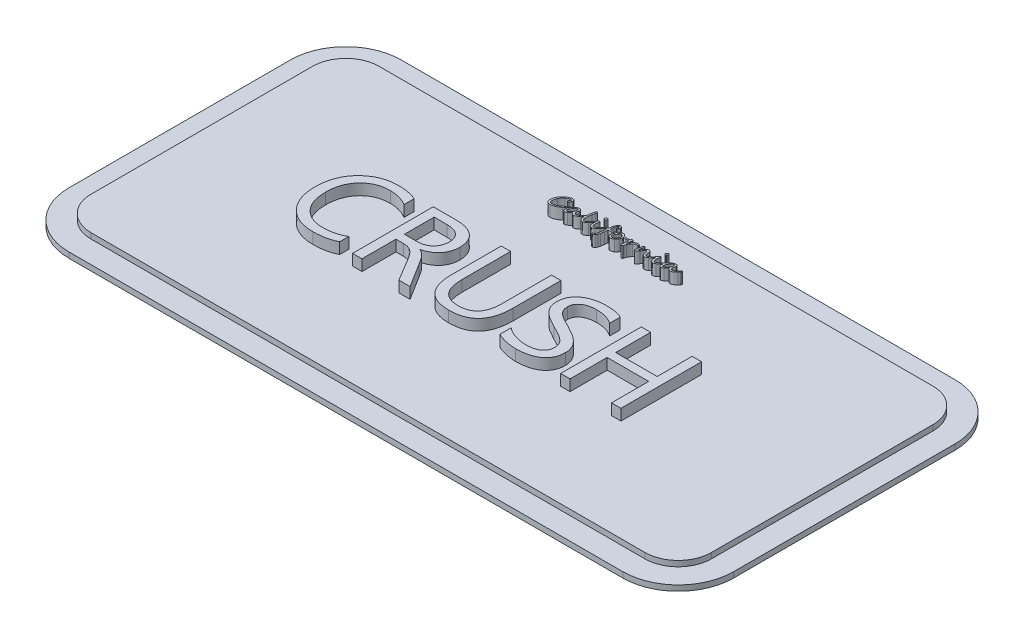
from build123d import *

# Parameters (mm, degrees)
SKETCH1_W           = 152.4
SKETCH1_H           = 76.2
BOSS_EXTRUDE1_DEPTH = 2.54
FILLET1_R           = 12.7
CUT_EXTRUDE2_DEPTH  = 1.27
BOSS_EXTRUDE2_DEPTH = 2.54
BOSS_EXTRUDE3_DEPTH = 2.54


with BuildPart() as part:
    # Sketch1 → Boss-Extrude1 (new body)
    with BuildSketch(Plane(origin=(0, 0, 0), x_dir=(1, 0, 0), z_dir=(0, 1, 0))):
        Rectangle(SKETCH1_W, SKETCH1_H)
    extrude(amount=BOSS_EXTRUDE1_DEPTH)

    # Fillet1
    fillet1_edges = [part.edges().sort_by_distance(p)[0] for p in [
        (76.2, 1.27, 38.1),
        (-76.2, 1.27, 38.1),
        (-76.2, 1.27, -38.1),
        (76.2, 1.27, -38.1),
    ]]
    fillet(fillet1_edges, radius=FILLET1_R)

    # Sketch4 → Cut-Extrude2 (cut)
    with BuildSketch(Plane(origin=(0, 2.54, 0), x_dir=(1, 0, 0), z_dir=(0, 1, 0))):
        with BuildLine():
            Line((-76.2, 25.4), (-76.2, -25.4))
            ThreePointArc((-76.2, -25.4), (-72.480256121, -34.380256121), (-63.5, -38.1))
            Line((-63.5, -38.1), (63.5, -38.1))
            ThreePointArc((63.5, -38.1), (72.480256121, -34.380256121), (76.2, -25.4))
            Line((76.2, -25.4), (76.2, 25.4))
            ThreePointArc((76.2, 25.4), (72.480256121, 34.380256121), (63.5, 38.1))
            Line((63.5, 38.1), (-63.5, 38.1))
            ThreePointArc((-63.5, 38.1), (-72.480256121, 34.380256121), (-76.2, 25.4))
        make_face()
        with BuildLine():
            Line((-71.12, 25.4), (-71.12, -25.4))
            ThreePointArc((-71.12, -25.4), (-68.888153673, -30.788153673), (-63.5, -33.02))
            Line((-63.5, -33.02), (63.5, -33.02))
            ThreePointArc((63.5, -33.02), (68.888153673, -30.788153673), (71.12, -25.4))
            Line((71.12, -25.4), (71.12, 25.4))
            ThreePointArc((71.12, 25.4), (68.888153673, 30.788153673), (63.5, 33.02))
            Line((63.5, 33.02), (-63.5, 33.02))
            ThreePointArc((-63.5, 33.02), (-68.888153673, 30.788153673), (-71.12, 25.4))
        make_face(mode=Mode.SUBTRACT)
    extrude(amount=-CUT_EXTRUDE2_DEPTH, mode=Mode.SUBTRACT)

    # Sketch3 → Boss-Extrude2 (add)
    # profile 1 of 5: a face of its own
    with BuildSketch(Plane(origin=(0, 2.54, 0), x_dir=(1, 0, 0), z_dir=(0, 1, 0))):
        with BuildLine():
            add(Edge.make_bspline(
                [(-30.641177348, -8.855397519), (-30.814739416, -8.942008388), (-31.167188977, -9.117887618), (-31.728960106, -9.329808872), (-32.317776493, -9.519383754), (-32.940350654, -9.664097554), (-33.59090457, -9.78382301), (-34.27413298, -9.864523734), (-34.988191762, -9.921377625), (-35.475664525, -9.925433836), (-35.724167272, -9.927501602)],
                knots=[0, 0, 0, 0, 0.887112729, 1.801444843, 2.744173258, 3.716129586, 4.723962956, 5.76983736, 6.863112805, 8, 8, 8, 8], degree=3))
            add(Edge.make_bspline(
                [(-35.724167272, -9.927501602), (-36.043900303, -9.920848486), (-36.669171925, -9.907837618), (-37.581990838, -9.787172383), (-38.446009363, -9.591262207), (-39.259931655, -9.312199203), (-40.026482968, -8.956748802), (-40.744865019, -8.522975977), (-41.409486808, -8.003464072), (-42.024153034, -7.415715776), (-42.579256451, -6.763547798), (-43.059130549, -6.053582745), (-43.464636752, -5.293378008), (-43.799688683, -4.486673325), (-44.059234899, -3.629553644), (-44.238989962, -2.724130815), (-44.351927449, -1.770450728), (-44.366026649, -1.117816803), (-44.373233896, -0.7842026)],
                knots=[0, 0, 0, 0, 1.081728051, 2.115433151, 3.110119772, 4.075884391, 5.02193166, 5.964969676, 6.909576816, 7.871246666, 8.838933359, 9.802542996, 10.765847113, 11.750383415, 12.754458422, 13.791637065, 14.871126348, 16, 16, 16, 16], degree=3))
            add(Edge.make_bspline(
                [(-44.373233896, -0.7842026), (-44.365717975, -0.425154123), (-44.35100982, 0.277479778), (-44.220871162, 1.303583422), (-44.020235427, 2.278883364), (-43.724314092, 3.198436983), (-43.352290987, 4.067496795), (-42.891884158, 4.882155627), (-42.351435478, 5.646018058), (-41.727524544, 6.346489728), (-41.042758851, 6.978216393), (-40.309311313, 7.53436011), (-39.529336304, 8.004473593), (-38.705202809, 8.389948811), (-37.836115926, 8.689097647), (-36.921687062, 8.894243687), (-35.965173152, 9.029459896), (-35.311513528, 9.043751853), (-34.979016917, 9.051021733)],
                knots=[0, 0, 0, 0, 1.128213627, 2.207838752, 3.246187037, 4.254048864, 5.239000571, 6.212902167, 7.190016613, 8.174871645, 9.15592468, 10.114387137, 11.06333179, 12.013212468, 12.969387343, 13.94635561, 14.955374059, 16, 16, 16, 16], degree=3))
            add(Edge.make_bspline(
                [(-34.979016917, 9.051021733), (-34.766075053, 9.047493147), (-34.348728575, 9.040577443), (-33.735620047, 9.004297364), (-33.150745143, 8.935447939), (-32.593468514, 8.840934248), (-32.064114699, 8.719166576), (-31.561336958, 8.572890683), (-31.088347999, 8.393452576), (-30.788640746, 8.253214692), (-30.641177348, 8.184214177)],
                knots=[0, 0, 0, 0, 1.145264206, 2.244612566, 3.301285475, 4.310774381, 5.282854785, 6.220893248, 7.124635377, 8, 8, 8, 8], degree=3))
            Line((-30.641177348, 8.184214177), (-30.641177348, 5.88793451))
            add(Edge.make_bspline(
                [(-30.641177348, 5.88793451), (-30.807134003, 5.985416583), (-31.136876667, 6.179105702), (-31.652377487, 6.425098257), (-32.178964221, 6.636165384), (-32.719287245, 6.806619147), (-33.273019319, 6.940753027), (-33.839721369, 7.034729403), (-34.41889761, 7.093802595), (-34.80906253, 7.10092049), (-35.005629429, 7.104506519)],
                knots=[0, 0, 0, 0, 1.006061279, 1.998963685, 2.983404741, 3.970518614, 4.958988398, 5.960171006, 6.972324671, 8, 8, 8, 8], degree=3))
            add(Edge.make_bspline(
                [(-35.005629429, 7.104506519), (-35.264499662, 7.098062503), (-35.770253645, 7.085472848), (-36.509672757, 6.983200237), (-37.212613152, 6.82259035), (-37.877209435, 6.588347114), (-38.505976306, 6.291750397), (-39.094035121, 5.922237539), (-39.647461517, 5.492430862), (-40.15688482, 4.997275516), (-40.614281345, 4.446397459), (-41.021466676, 3.851928735), (-41.360193296, 3.2097344), (-41.634672682, 2.522106274), (-41.850702559, 1.791572684), (-42.00669107, 1.015736815), (-42.098179556, 0.196335113), (-42.109292494, -0.364505211), (-42.114972105, -0.651140036)],
                knots=[0, 0, 0, 0, 1.048427764, 2.048310116, 3.01848634, 3.965173324, 4.89759301, 5.829333914, 6.773190278, 7.731762594, 8.701408819, 9.669776419, 10.645912179, 11.636523898, 12.66484484, 13.728165204, 14.838908434, 16, 16, 16, 16], degree=3))
            add(Edge.make_bspline(
                [(-42.114972105, -0.651140036), (-42.108755777, -0.923804383), (-42.096639795, -1.455242961), (-42.013180456, -2.232574839), (-41.869560863, -2.966600501), (-41.668051021, -3.659301146), (-41.408520712, -4.308672648), (-41.094087776, -4.917714753), (-40.712045751, -5.478052549), (-40.285600481, -5.999763383), (-39.80777876, -6.465364403), (-39.290574088, -6.872334199), (-38.737583833, -7.216219771), (-38.14659338, -7.495397124), (-37.520472799, -7.712235179), (-36.85931373, -7.866915605), (-36.163081513, -7.965676808), (-35.686491753, -7.975807213), (-35.442834995, -7.980986388)],
                knots=[0, 0, 0, 0, 1.171667554, 2.283647813, 3.354875295, 4.381962779, 5.379073579, 6.355840705, 7.321001055, 8.288125986, 9.247043768, 10.181780364, 11.111171383, 12.039285107, 12.984810395, 13.95303865, 14.953489963, 16, 16, 16, 16], degree=3))
            add(Edge.make_bspline(
                [(-35.442834995, -7.980986388), (-35.215871968, -7.97745337), (-34.768816471, -7.970494283), (-34.109855007, -7.911953903), (-33.473582334, -7.817763769), (-32.860018665, -7.684746255), (-32.269181386, -7.513635396), (-31.702254458, -7.30476908), (-31.157911217, -7.057359498), (-30.813427856, -6.862066088), (-30.641177348, -6.76441438)],
                knots=[0, 0, 0, 0, 1.086157957, 2.139436069, 3.163671197, 4.163034773, 5.142016212, 6.10538992, 7.052646413, 8, 8, 8, 8], degree=3))
            Line((-30.641177348, -6.76441438), (-30.641177348, -8.855397519))
        make_face()
    # profile 2 of 5: a face of its own
    with BuildSketch(Plane(origin=(0, 2.54, 0), x_dir=(1, 0, 0), z_dir=(0, 1, 0))):
        with BuildLine():
            Line((-13.673799616, -9.6841872), (-16.240006196, -9.6841872))
            Line((-16.240006196, -9.6841872), (-19.319454093, -4.551774039))
            add(Edge.make_bspline(
                [(-19.319454093, -4.551774039), (-19.454119596, -4.328978548), (-19.707505839, -3.909767159), (-20.118541693, -3.350479772), (-20.519848972, -2.879609102), (-20.939764705, -2.509292433), (-21.376529704, -2.217175134), (-21.857353206, -2.032234855), (-22.380738501, -1.917301559), (-22.746731805, -1.904724888), (-22.938755819, -1.898126345)],
                knots=[0, 0, 0, 0, 1.316368587, 2.47687554, 3.508210226, 4.439431764, 5.301929479, 6.15078469, 7.029780756, 8, 8, 8, 8], degree=3))
            Line((-22.938755819, -1.898126345), (-24.706587019, -1.898126345))
            Line((-24.706587019, -1.898126345), (-24.706587019, -9.6841872))
            Line((-24.706587019, -9.6841872), (-26.862200547, -9.6841872))
            Line((-26.862200547, -9.6841872), (-26.862200547, 8.807707331))
            Line((-26.862200547, 8.807707331), (-21.372419358, 8.807707331))
            add(Edge.make_bspline(
                [(-21.372419358, 8.807707331), (-21.175877082, 8.804015417), (-20.788283334, 8.796734729), (-20.218493226, 8.740478905), (-19.672850997, 8.639565571), (-19.151058547, 8.508110657), (-18.655703187, 8.339183434), (-18.194298988, 8.124628099), (-17.76445954, 7.873862839), (-17.372330421, 7.578509785), (-17.012621037, 7.249778137), (-16.698179114, 6.875167355), (-16.424967151, 6.464121922), (-16.191226227, 6.016323868), (-16.002603569, 5.530169067), (-15.871405158, 5.001460042), (-15.790333943, 4.433096122), (-15.780990716, 4.040548197), (-15.776188118, 3.838771033)],
                knots=[0, 0, 0, 0, 1.114166287, 2.197206093, 3.241423268, 4.257303049, 5.245652254, 6.203555642, 7.137531876, 8.061451022, 8.98164755, 9.89418362, 10.82672186, 11.77468589, 12.752666362, 13.775508554, 14.856568722, 16, 16, 16, 16], degree=3))
            add(Edge.make_bspline(
                [(-15.776188118, 3.838771033), (-15.780078149, 3.680227953), (-15.787724934, 3.368573642), (-15.840930247, 2.910353388), (-15.933009754, 2.471907002), (-16.057442606, 2.052851743), (-16.218116963, 1.656460045), (-16.409463347, 1.281494075), (-16.630045485, 0.927437273), (-16.880239104, 0.594796443), (-17.165860455, 0.292567518), (-17.468384318, 0.001811363), (-17.809260583, -0.252739635), (-18.171364387, -0.490899137), (-18.558370285, -0.701971274), (-18.968951418, -0.891358034), (-19.405012156, -1.04881332), (-19.70671727, -1.135663219), (-19.859307922, -1.179588502)],
                knots=[0, 0, 0, 0, 1.084841461, 2.132515136, 3.151257536, 4.147155944, 5.119789894, 6.073845222, 7.024307407, 7.971281936, 8.916308896, 9.867245679, 10.838525658, 11.822268317, 12.831331675, 13.851880979, 14.913565373, 16, 16, 16, 16], degree=3))
            Line((-19.859307922, -1.179588502), (-19.859307922, -1.232813528))
            add(Edge.make_bspline(
                [(-19.859307922, -1.232813528), (-19.712678798, -1.30246659), (-19.432192938, -1.435705463), (-19.054771674, -1.69365177), (-18.71001503, -1.979596568), (-18.397236184, -2.32092121), (-18.085078896, -2.701879176), (-17.78694242, -3.14538331), (-17.463377815, -3.641438395), (-17.24300153, -3.995002802), (-17.12582269, -4.183000649)],
                knots=[0, 0, 0, 0, 0.950325846, 1.817871894, 2.672144773, 3.570912724, 4.52705863, 5.557562349, 6.701303048, 8, 8, 8, 8], degree=3))
            Line((-17.12582269, -4.183000649), (-13.673799616, -9.6841872))
        make_face()
        with BuildLine():
            Line((-24.706587019, 6.861192117), (-24.706587019, 0.048388869))
            Line((-24.706587019, 0.048388869), (-21.783012411, 0.048388869))
            add(Edge.make_bspline(
                [(-21.783012411, 0.048388869), (-21.651119485, 0.051403393), (-21.390332642, 0.057363896), (-21.006703487, 0.10177468), (-20.640400719, 0.184762206), (-20.288059525, 0.28728806), (-19.959189819, 0.4324336), (-19.644753701, 0.590234925), (-19.363476726, 0.790685851), (-19.096924936, 1.004512665), (-18.862365876, 1.255684278), (-18.647654165, 1.52638351), (-18.469384122, 1.829212184), (-18.311876449, 2.152048735), (-18.186295566, 2.500881694), (-18.100414949, 2.8723394), (-18.045550832, 3.261807604), (-18.038198752, 3.528103758), (-18.034449909, 3.663888807)],
                knots=[0, 0, 0, 0, 1.080822019, 2.137068088, 3.157586804, 4.156260862, 5.138054093, 6.099591689, 7.032899498, 7.962328278, 8.895173767, 9.842417021, 10.788122034, 11.768156171, 12.783164829, 13.818424639, 14.887609475, 16, 16, 16, 16], degree=3))
            add(Edge.make_bspline(
                [(-18.034449909, 3.663888807), (-18.037084931, 3.785729994), (-18.042237174, 4.023965337), (-18.090809463, 4.370785729), (-18.158942, 4.699810485), (-18.268309509, 5.00425628), (-18.400399841, 5.290863214), (-18.570595719, 5.552269633), (-18.763727653, 5.798383011), (-18.990170782, 6.018612622), (-19.243112067, 6.218317701), (-19.52328982, 6.392472989), (-19.831118572, 6.537833315), (-20.165407041, 6.654826638), (-20.524659608, 6.750967654), (-20.913328823, 6.812389053), (-21.325747413, 6.857249945), (-21.610530542, 6.859856836), (-21.756399898, 6.861192117)],
                knots=[0, 0, 0, 0, 1.048446333, 2.050020839, 3.011069113, 3.935940766, 4.82918067, 5.722153935, 6.615127199, 7.517913652, 8.434768652, 9.385540703, 10.351963352, 11.359759798, 12.431678785, 13.549277905, 14.744710569, 16, 16, 16, 16], degree=3))
            Line((-21.756399898, 6.861192117), (-24.706587019, 6.861192117))
        make_face(mode=Mode.SUBTRACT)
    # profile 3 of 5: a face of its own
    with BuildSketch(Plane(origin=(0, 2.54, 0), x_dir=(1, 0, 0), z_dir=(0, 1, 0))):
        with BuildLine():
            add(Edge.make_bspline(
                [(2.411563411, -2.164251472), (2.407102341, -2.477468901), (2.398434006, -3.086083642), (2.313202699, -3.967668573), (2.178294196, -4.788899178), (1.98943082, -5.550393153), (1.743931607, -6.251397877), (1.441136805, -6.89176652), (1.089548911, -7.474649152), (0.673391181, -7.99145905), (0.207957894, -8.451475897), (-0.314242218, -8.850308281), (-0.891412701, -9.186394098), (-1.526069165, -9.455793141), (-2.21251914, -9.668844213), (-2.953780909, -9.818724289), (-3.748770277, -9.911576361), (-4.297056947, -9.922081757), (-4.579923851, -9.927501602)],
                knots=[0, 0, 0, 0, 1.255055471, 2.438706115, 3.545927384, 4.588095638, 5.579260292, 6.517599315, 7.422673162, 8.300779934, 9.169954148, 10.039543793, 10.927234552, 11.839590271, 12.797061879, 13.803145311, 14.866619384, 16, 16, 16, 16], degree=3))
            add(Edge.make_bspline(
                [(-4.579923851, -9.927501602), (-4.850106488, -9.921748149), (-5.375473848, -9.910560618), (-6.137249845, -9.82173244), (-6.848464398, -9.680382131), (-7.506015698, -9.474654362), (-8.111453971, -9.210812091), (-8.667430932, -8.892953624), (-9.165519528, -8.507211506), (-9.613048832, -8.066738919), (-10.012886194, -7.570310066), (-10.349666852, -7.008698718), (-10.641072656, -6.39309462), (-10.874680558, -5.716965332), (-11.056823321, -4.98400021), (-11.182658693, -4.194079183), (-11.265065087, -3.34708046), (-11.274039304, -2.76260594), (-11.278673474, -2.460790899)],
                knots=[0, 0, 0, 0, 1.127605094, 2.192616516, 3.196917095, 4.150619773, 5.062698346, 5.949196032, 6.816851807, 7.684733337, 8.56545078, 9.470011502, 10.411858595, 11.404005604, 12.450982311, 13.560725107, 14.74039017, 16, 16, 16, 16], degree=3))
            Line((-11.278673474, -2.460790899), (-11.278673474, 8.807707331))
            Line((-11.278673474, 8.807707331), (-9.123059946, 8.807707331))
            Line((-9.123059946, 8.807707331), (-9.123059946, -2.316322973))
            add(Edge.make_bspline(
                [(-9.123059946, -2.316322973), (-9.119713835, -2.544563974), (-9.113214963, -2.987857394), (-9.054558611, -3.630261671), (-8.96507548, -4.230150696), (-8.838877709, -4.787350926), (-8.665150169, -5.296925853), (-8.465545438, -5.767005108), (-8.223136596, -6.190675744), (-7.936370384, -6.565747566), (-7.623056824, -6.904626426), (-7.263411063, -7.191301438), (-6.869072354, -7.436193847), (-6.437810469, -7.637776269), (-5.968570537, -7.794961574), (-5.462241914, -7.902926564), (-4.918710234, -7.967991293), (-4.544627771, -7.976566512), (-4.351816599, -7.980986388)],
                knots=[0, 0, 0, 0, 1.291837704, 2.5090284, 3.648447646, 4.723894186, 5.737984357, 6.692248713, 7.611458971, 8.492444215, 9.360274196, 10.217392579, 11.08735497, 11.982768831, 12.906113155, 13.882688314, 14.908686216, 16, 16, 16, 16], degree=3))
            add(Edge.make_bspline(
                [(-4.351816599, -7.980986388), (-4.165413651, -7.976039807), (-3.804253004, -7.966455675), (-3.278704511, -7.908758516), (-2.792274453, -7.795861872), (-2.337727571, -7.650277292), (-1.92260072, -7.453280357), (-1.537682435, -7.222605513), (-1.192210438, -6.942246276), (-0.888436679, -6.615532593), (-0.614726702, -6.25099389), (-0.37949931, -5.842306386), (-0.181599258, -5.390826131), (-0.022693932, -4.896099791), (0.101257649, -4.359264062), (0.19238442, -3.780071755), (0.244773731, -3.158752502), (0.252148268, -2.730817225), (0.255949883, -2.510214137)],
                knots=[0, 0, 0, 0, 1.09287786, 2.11747978, 3.092407566, 4.01558842, 4.909525814, 5.779658965, 6.640483565, 7.507567397, 8.388571923, 9.307198861, 10.265082689, 11.272851106, 12.348553284, 13.491651855, 14.706932151, 16, 16, 16, 16], degree=3))
            Line((0.255949883, -2.510214137), (0.255949883, 8.807707331))
            Line((0.255949883, 8.807707331), (2.411563411, 8.807707331))
            Line((2.411563411, 8.807707331), (2.411563411, -2.164251472))
        make_face()
    # profile 4 of 5: a face of its own
    with BuildSketch(Plane(origin=(0, 2.54, 0), x_dir=(1, 0, 0), z_dir=(0, 1, 0))):
        with BuildLine():
            Line((6.095495525, -8.817379644), (6.095495525, -6.277785576))
            add(Edge.make_bspline(
                [(6.095495525, -6.277785576), (6.251988432, -6.407647191), (6.577979278, -6.678162312), (7.145353522, -7.007394639), (7.768372538, -7.290386052), (8.423982996, -7.533825177), (9.097056358, -7.725028131), (9.767267416, -7.869260905), (10.414409865, -7.960207865), (10.836069396, -7.974261971), (11.03781931, -7.980986388)],
                knots=[0, 0, 0, 0, 0.915775475, 1.907654646, 2.945853197, 4.000036019, 5.058238913, 6.098433231, 7.090164211, 8, 8, 8, 8], degree=3))
            add(Edge.make_bspline(
                [(11.03781931, -7.980986388), (11.198828215, -7.978970506), (11.509828602, -7.975076684), (11.960454731, -7.940387684), (12.3796252, -7.884388101), (12.767319433, -7.805338656), (13.12456675, -7.704178066), (13.447752482, -7.57333752), (13.743118, -7.425898383), (14.007742821, -7.255757087), (14.236440216, -7.05790203), (14.442172383, -6.846745141), (14.606798348, -6.607080186), (14.752525692, -6.355476301), (14.857767717, -6.077721941), (14.932661482, -5.78171506), (14.979987716, -5.465706371), (14.985193978, -5.248940084), (14.98787655, -5.137249318)],
                knots=[0, 0, 0, 0, 1.398015257, 2.700367949, 3.922112806, 5.068158235, 6.133875913, 7.141352531, 8.091224763, 8.997779399, 9.864377875, 10.712899637, 11.549563429, 12.382237039, 13.232398596, 14.118551283, 15.030566739, 16, 16, 16, 16], degree=3))
            add(Edge.make_bspline(
                [(14.98787655, -5.137249318), (14.984587594, -5.017878198), (14.978139172, -4.783835735), (14.917307031, -4.445710468), (14.812950202, -4.131012091), (14.666554441, -3.840962025), (14.484177022, -3.569670123), (14.275483487, -3.308892363), (14.029297214, -3.066076061), (13.652688926, -2.749616476), (13.109363211, -2.370756979), (12.368554493, -1.954788033), (11.552148678, -1.529889986), (10.984835301, -1.241223788), (10.691856645, -1.092147389)],
                knots=[0, 0, 0, 0, 0.688034168, 1.348979647, 1.973048348, 2.594113607, 3.21646783, 3.855718171, 4.517269596, 5.207009893, 6.691421329, 8.328742835, 10.104046132, 12, 12, 12, 12], degree=3))
            add(Edge.make_bspline(
                [(10.691856645, -1.092147389), (10.380532236, -0.930316773), (9.774106645, -0.615088591), (9.037946738, -0.203140339), (8.492728185, 0.14478636), (8.115659835, 0.413390594), (7.768856479, 0.697859457), (7.44267338, 0.988449616), (7.149493647, 1.300788626), (6.88779198, 1.632867791), (6.666009427, 1.988238027), (6.466306329, 2.359791537), (6.309662671, 2.761121098), (6.199676674, 3.195140142), (6.135369731, 3.660691966), (6.126608835, 3.981767452), (6.122108037, 4.146715823)],
                knots=[0, 0, 0, 0, 1.993602988, 3.883318606, 4.790071322, 5.667240751, 6.511739756, 7.337523239, 8.147428141, 8.942474697, 9.735464629, 10.524522357, 11.336121722, 12.176096675, 13.062993301, 14, 14, 14, 14], degree=3))
            add(Edge.make_bspline(
                [(6.122108037, 4.146715823), (6.128359592, 4.349910558), (6.14051838, 4.745108513), (6.244134389, 5.317547742), (6.420160023, 5.846705258), (6.662765657, 6.333490141), (6.960647396, 6.778295431), (7.304582105, 7.183171968), (7.690963964, 7.546567178), (8.120207788, 7.868039812), (8.58878645, 8.144467439), (9.083187237, 8.397613424), (9.616021898, 8.594625577), (10.17189393, 8.762695268), (10.747106702, 8.888169312), (11.330262001, 8.986613074), (11.920142157, 9.038681508), (12.315132923, 9.046904375), (12.51291287, 9.051021733)],
                knots=[0, 0, 0, 0, 1.081497315, 2.103428159, 3.085124815, 4.041869154, 4.990846321, 5.9292783, 6.865037162, 7.809853764, 8.778590545, 9.759474971, 10.763420585, 11.798965231, 12.850115676, 13.896358539, 14.946663737, 16, 16, 16, 16], degree=3))
            add(Edge.make_bspline(
                [(12.51291287, 9.051021733), (12.732197202, 9.04902134), (13.154577911, 9.045168228), (13.76597509, 9.010524077), (14.330617337, 8.954803219), (14.851724624, 8.876901292), (15.324792609, 8.76986651), (15.754689526, 8.646959563), (16.136707478, 8.496058343), (16.36765824, 8.37256931), (16.478177261, 8.313474952)],
                knots=[0, 0, 0, 0, 1.291186552, 2.487055441, 3.604570826, 4.631482738, 5.587396381, 6.458707626, 7.262430997, 8, 8, 8, 8], degree=3))
            Line((16.478177261, 8.313474952), (16.478177261, 5.88793451))
            add(Edge.make_bspline(
                [(16.478177261, 5.88793451), (16.339341016, 5.985862934), (16.059976838, 6.182913016), (15.604566748, 6.427570625), (15.124072074, 6.637704851), (14.614166074, 6.810009152), (14.074618944, 6.941553491), (13.506591392, 7.035867934), (12.910789951, 7.094266237), (12.504178866, 7.101041301), (12.296210981, 7.104506519)],
                knots=[0, 0, 0, 0, 0.919462884, 1.850129207, 2.793739702, 3.757430578, 4.761226926, 5.798194742, 6.873850716, 8, 8, 8, 8], degree=3))
            add(Edge.make_bspline(
                [(12.296210981, 7.104506519), (12.060179574, 7.096475857), (11.585609623, 7.080329232), (10.998182765, 6.989917397), (10.542974554, 6.873425208), (10.216234689, 6.767997175), (9.909626117, 6.635303534), (9.623104381, 6.479084066), (9.359457922, 6.301039728), (9.122296667, 6.097054108), (8.906996966, 5.872284668), (8.719938565, 5.62070237), (8.56463465, 5.342639343), (8.458965642, 5.03228026), (8.392966167, 4.694428556), (8.384666286, 4.458786161), (8.380369829, 4.336805199)],
                knots=[0, 0, 0, 0, 1.845514419, 3.710631985, 4.630992488, 5.517672431, 6.391921016, 7.238792622, 8.065961388, 8.874101195, 9.680051577, 10.49448333, 11.319215659, 12.158986711, 13.046994186, 14, 14, 14, 14], degree=3))
            add(Edge.make_bspline(
                [(8.380369829, 4.336805199), (8.382840729, 4.223837266), (8.387641695, 4.004340341), (8.437702976, 3.686306399), (8.521947258, 3.391933573), (8.635959897, 3.117376054), (8.788513232, 2.864674775), (8.967687098, 2.622415479), (9.182393362, 2.396231587), (9.513858897, 2.09621317), (10.01235661, 1.747093014), (10.564650659, 1.415474414), (11.065690838, 1.158455715), (11.474825508, 0.944029143), (11.914061774, 0.723687573), (12.216301333, 0.574154045), (12.372246732, 0.496999797)],
                knots=[0, 0, 0, 0, 0.805551104, 1.565187447, 2.289282411, 2.986221276, 3.679396055, 4.390100217, 5.132206223, 5.900404531, 7.576984061, 9.462627659, 10.493971681, 11.593979481, 12.758574721, 14, 14, 14, 14], degree=3))
            add(Edge.make_bspline(
                [(12.372246732, 0.496999797), (12.694744866, 0.33446374), (13.33020777, 0.014196353), (14.090205139, -0.432652929), (14.672667934, -0.795917951), (15.073358539, -1.0891918), (15.448474846, -1.394205528), (15.79510507, -1.71299801), (16.11229429, -2.048868009), (16.399392219, -2.401070145), (16.645467259, -2.77603297), (16.862072929, -3.164981781), (17.036936128, -3.579208125), (17.155300226, -4.023254463), (17.236248231, -4.494335597), (17.242786064, -4.818805651), (17.246138341, -4.985177817)],
                knots=[0, 0, 0, 0, 1.951180664, 3.844682502, 4.762313817, 5.65958065, 6.525971749, 7.374116384, 8.202566564, 9.02079121, 9.826160562, 10.623070133, 11.424352475, 12.248460212, 13.101897188, 14, 14, 14, 14], degree=3))
            add(Edge.make_bspline(
                [(17.246138341, -4.985177817), (17.239705017, -5.203524337), (17.227290715, -5.624864814), (17.128546045, -6.230963612), (16.96091111, -6.784693062), (16.72756206, -7.28690569), (16.435059828, -7.737266979), (16.097673201, -8.145177086), (15.711872927, -8.507756812), (15.278651892, -8.823908179), (14.806919135, -9.095921173), (14.300253866, -9.329429492), (13.759795499, -9.523395247), (13.186626404, -9.673125409), (12.590185779, -9.784541507), (11.9763114, -9.869422043), (11.345347912, -9.919672593), (10.918785707, -9.924873703), (10.703262008, -9.927501602)],
                knots=[0, 0, 0, 0, 1.129777737, 2.180117595, 3.167796441, 4.115684128, 5.036354037, 5.940042921, 6.849569311, 7.769257272, 8.709808362, 9.663646495, 10.653348985, 11.677996872, 12.72647117, 13.792364936, 14.884576105, 16, 16, 16, 16], degree=3))
            add(Edge.make_bspline(
                [(10.703262008, -9.927501602), (10.540968943, -9.922730969), (10.180237633, -9.912127209), (9.603972293, -9.857931255), (8.969681232, -9.767804759), (8.316980136, -9.644961669), (7.673843728, -9.487792384), (7.160245095, -9.324870542), (6.775671032, -9.18605141), (6.521798987, -9.068783494), (6.294849867, -8.951583936), (6.159402887, -8.860401743), (6.095495525, -8.817379644)],
                knots=[0, 0, 0, 0, 1.01684031, 2.260146727, 3.622990176, 5.028825148, 6.418861315, 7.767038485, 8.402525722, 8.978017834, 9.517802583, 10, 10, 10, 10], degree=3))
        make_face()
    # profile 5 of 5: a face of its own
    with BuildSketch(Plane(origin=(0, 2.54, 0), x_dir=(1, 0, 0), z_dir=(0, 1, 0))):
        Polygon((34.658325215, -9.6841872), (32.502711687, -9.6841872), (32.502711687, -1.16818314), (22.98303572, -1.16818314), (22.98303572, -9.6841872), (20.827422192, -9.6841872), (20.827422192, 8.807707331), (22.98303572, 8.807707331), (22.98303572, 0.778332074), (32.502711687, 0.778332074), (32.502711687, 8.807707331), (34.658325215, 8.807707331), align=None)
    extrude(amount=BOSS_EXTRUDE2_DEPTH)

    # Sketch5 → Boss-Extrude3 (add)
    # profile 1 of 12: a face of its own
    with BuildSketch(Plane(origin=(0, 2.54, 0), x_dir=(1, 0, 0), z_dir=(0, 1, 0))):
        with BuildLine():
            add(Edge.make_bspline(
                [(-11.156666667, 24.364607372), (-11.157131794, 24.351919498), (-11.158101101, 24.325478497), (-11.169204648, 24.285444271), (-11.184094086, 24.242953222), (-11.207904635, 24.199426178), (-11.235258913, 24.152495172), (-11.270205896, 24.103888134), (-11.311664654, 24.053745367), (-11.342088791, 24.02023243), (-11.357888622, 24.002828526)],
                knots=[0, 0, 0, 0, 0.718578145, 1.497486989, 2.345563214, 3.271470083, 4.307005623, 5.43008171, 6.665392699, 8, 8, 8, 8], degree=3))
            add(Edge.make_bspline(
                [(-11.357888622, 24.002828526), (-11.376234747, 23.983783319), (-11.415911506, 23.942594669), (-11.481147008, 23.880104642), (-11.555147957, 23.815335327), (-11.632760641, 23.74846262), (-11.713560054, 23.682089253), (-11.794126209, 23.616864687), (-11.871858733, 23.553748874), (-11.92337268, 23.514269154), (-11.948233173, 23.495216346)],
                knots=[0, 0, 0, 0, 0.814396614, 1.761277603, 2.781024452, 3.842784778, 4.916433114, 6.001218582, 7.035393434, 8, 8, 8, 8], degree=3))
            add(Edge.make_bspline(
                [(-11.948233173, 23.495216346), (-12.02533182, 23.437969457), (-12.180554839, 23.322714064), (-12.422387542, 23.162397957), (-12.671012405, 23.016204739), (-12.882731502, 22.909405898), (-13.052031484, 22.833010685), (-13.179225069, 22.784853501), (-13.305224931, 22.739834365), (-13.431136665, 22.702794266), (-13.555896209, 22.67335704), (-13.678670783, 22.651168644), (-13.79961349, 22.638199214), (-13.879560808, 22.636487361), (-13.919086538, 22.635641026)],
                knots=[0, 0, 0, 0, 1.582044042, 3.185135662, 4.778117635, 6.331482907, 7.08999699, 7.8372948, 8.571662329, 9.294223519, 9.998483261, 10.682859781, 11.348809549, 12, 12, 12, 12], degree=3))
            add(Edge.make_bspline(
                [(-13.919086538, 22.635641026), (-13.960486412, 22.636644885), (-14.0404719, 22.638584363), (-14.156488293, 22.651726267), (-14.264054738, 22.67474307), (-14.363473599, 22.706942456), (-14.4545085, 22.747936738), (-14.537786572, 22.796186216), (-14.61270152, 22.852865373), (-14.679883573, 22.916816829), (-14.738147907, 22.989064537), (-14.788904562, 23.067718451), (-14.831062001, 23.153789913), (-14.866286406, 23.246151816), (-14.892261287, 23.345500164), (-14.912251025, 23.449903589), (-14.923213572, 23.559954813), (-14.924989366, 23.634951164), (-14.925897436, 23.673301282)],
                knots=[0, 0, 0, 0, 1.206571878, 2.331124018, 3.397243512, 4.407478247, 5.370885357, 6.30196562, 7.206532359, 8.102596131, 8.998323285, 9.905246337, 10.825197751, 11.786652471, 12.781336373, 13.814009376, 14.882172287, 16, 16, 16, 16], degree=3))
            add(Edge.make_bspline(
                [(-14.925897436, 23.673301282), (-14.925960669, 23.709079714), (-14.926088149, 23.781209627), (-14.916534593, 23.889464126), (-14.904005647, 23.998931564), (-14.875960065, 24.145625783), (-14.829818382, 24.328886228), (-14.756336049, 24.545025025), (-14.664048446, 24.754844175), (-14.557341176, 24.957199573), (-14.436294229, 25.147941446), (-14.345318996, 25.2661858), (-14.300496795, 25.324443109)],
                knots=[0, 0, 0, 0, 0.596540402, 1.202635359, 1.81144513, 2.433883344, 3.692420458, 4.961055646, 6.237287877, 7.512143821, 8.774268709, 10, 10, 10, 10], degree=3))
            add(Edge.make_bspline(
                [(-14.300496795, 25.324443109), (-14.271369481, 25.359079298), (-14.21127102, 25.430544234), (-14.112775275, 25.534703352), (-14.006435476, 25.637903088), (-13.895109637, 25.738954798), (-13.780111278, 25.835194054), (-13.663024421, 25.925140638), (-13.546404479, 26.007173691), (-13.466896664, 26.055426741), (-13.428301282, 26.07885016)],
                knots=[0, 0, 0, 0, 0.937392274, 1.93412384, 2.968128863, 4.006737102, 5.04818529, 6.073710754, 7.064923746, 8, 8, 8, 8], degree=3))
            add(Edge.make_bspline(
                [(-13.428301282, 26.07885016), (-13.4152564, 26.086405619), (-13.387732457, 26.102347198), (-13.34329217, 26.125940736), (-13.294411885, 26.152030734), (-13.221333034, 26.188911706), (-13.123984793, 26.235161282), (-13.002423298, 26.286615919), (-12.878743471, 26.332401962), (-12.775939138, 26.365612063), (-12.695877481, 26.38515905), (-12.640377825, 26.396996608), (-12.588744846, 26.403410379), (-12.555652421, 26.404402113), (-12.539979968, 26.404871795)],
                knots=[0, 0, 0, 0, 0.568962076, 1.200476958, 1.89892771, 2.660331074, 4.290020315, 5.966106207, 7.640775456, 9.267381942, 10.039744232, 10.750782685, 11.408375187, 12, 12, 12, 12], degree=3))
            add(Edge.make_bspline(
                [(-12.539979968, 26.404871795), (-12.517071661, 26.404568019), (-12.473797069, 26.403994174), (-12.412480199, 26.400694825), (-12.358302355, 26.39468823), (-12.296988206, 26.382628874), (-12.227405427, 26.362518775), (-12.179785941, 26.333059988), (-12.156466346, 26.318633814)],
                knots=[0, 0, 0, 0, 1.032624001, 1.950662754, 2.767363503, 3.486357824, 4.769051841, 6, 6, 6, 6], degree=3))
            add(Edge.make_bspline(
                [(-12.156466346, 26.318633814), (-12.145009063, 26.30906675), (-12.118930544, 26.287290657), (-12.082549224, 26.245568988), (-12.042750561, 26.197130002), (-12.006352066, 26.142305951), (-11.971193796, 26.086622618), (-11.94550254, 26.030280434), (-11.924357164, 25.979506971), (-11.920975406, 25.946250093), (-11.919487179, 25.931614583)],
                knots=[0, 0, 0, 0, 0.773396512, 1.760368163, 2.864418824, 4.024767054, 5.172693885, 6.27374395, 7.24031847, 8, 8, 8, 8], degree=3))
            add(Edge.make_bspline(
                [(-11.919487179, 25.931614583), (-11.9198971, 25.924084816), (-11.920823836, 25.907061731), (-11.929854665, 25.879862721), (-11.941465537, 25.847394265), (-11.965009027, 25.797424605), (-11.998928571, 25.729502258), (-12.045914197, 25.647519208), (-12.095534979, 25.566646204), (-12.137785619, 25.503160943), (-12.169151639, 25.457137856), (-12.189482119, 25.429080653), (-12.206794684, 25.406426923), (-12.218099968, 25.393799654), (-12.223072917, 25.388245192)],
                knots=[0, 0, 0, 0, 0.431039679, 0.974482262, 1.632177399, 2.412450124, 4.139787591, 5.98955877, 7.83197419, 9.583918254, 10.365112471, 11.027711782, 11.572311506, 12, 12, 12, 12], degree=3))
            add(Edge.make_bspline(
                [(-12.223072917, 25.388245192), (-12.239046292, 25.372045476), (-12.269377213, 25.341284769), (-12.322967869, 25.308904769), (-12.377448331, 25.286445625), (-12.4154399, 25.284186938), (-12.434110577, 25.283076923)],
                knots=[0, 0, 0, 0, 1.121121629, 2.128833136, 3.080428795, 4, 4, 4, 4], degree=3))
            add(Edge.make_bspline(
                [(-12.434110577, 25.283076923), (-12.449164774, 25.283591662), (-12.478102513, 25.284581113), (-12.518588355, 25.296549321), (-12.554900983, 25.313693984), (-12.584372622, 25.339832442), (-12.608506371, 25.37061647), (-12.625278427, 25.406132935), (-12.63549797, 25.445173291), (-12.636773708, 25.472314309), (-12.637435897, 25.486402244)],
                knots=[0, 0, 0, 0, 1.112377891, 2.138254322, 3.106924773, 4.065468113, 5.02901041, 5.990056479, 6.956709996, 8, 8, 8, 8], degree=3))
            add(Edge.make_bspline(
                [(-12.637435897, 25.486402244), (-12.63696876, 25.49229286), (-12.635897315, 25.505803807), (-12.627807584, 25.527460848), (-12.616730641, 25.553601244), (-12.600295106, 25.583482744), (-12.579646755, 25.617363243), (-12.551552218, 25.652777728), (-12.519089105, 25.691613234), (-12.493706224, 25.716585434), (-12.480384615, 25.729691506)],
                knots=[0, 0, 0, 0, 0.479735115, 1.100339117, 1.868378627, 2.797479364, 3.875937108, 5.099174853, 6.47757001, 8, 8, 8, 8], degree=3))
            add(Edge.make_bspline(
                [(-12.480384615, 25.729691506), (-12.454393062, 25.755441826), (-12.40658376, 25.8028074), (-12.358761843, 25.867130538), (-12.327782666, 25.911292821), (-12.311431604, 25.937934748), (-12.298410758, 25.958262272), (-12.291743499, 25.970152756), (-12.288978365, 25.975084135)],
                knots=[0, 0, 0, 0, 2.105533736, 3.872954423, 4.60902373, 5.214433592, 5.674199505, 6, 6, 6, 6], degree=3))
            add(Edge.make_bspline(
                [(-12.288978365, 25.975084135), (-12.306186151, 25.985576025), (-12.342704294, 26.007841783), (-12.405067693, 26.027888658), (-12.469209503, 26.042596649), (-12.512325693, 26.044828754), (-12.53296875, 26.045897436)],
                knots=[0, 0, 0, 0, 0.937387153, 1.989311127, 3.037327641, 4, 4, 4, 4], degree=3))
            add(Edge.make_bspline(
                [(-12.53296875, 26.045897436), (-12.548194608, 26.04556948), (-12.580232311, 26.044879407), (-12.630441908, 26.035900076), (-12.685912467, 26.024564577), (-12.767020837, 25.999935276), (-12.873949199, 25.962548134), (-13.002713881, 25.905608426), (-13.131882671, 25.840770769), (-13.255590097, 25.770215944), (-13.368310743, 25.698895572), (-13.435617195, 25.647624001), (-13.466862981, 25.623822115)],
                knots=[0, 0, 0, 0, 0.439850463, 0.925517498, 1.471760916, 2.077162963, 3.374908721, 4.746268734, 6.145941874, 7.553687989, 8.864344518, 10, 10, 10, 10], degree=3))
            add(Edge.make_bspline(
                [(-13.466862981, 25.623822115), (-13.507134091, 25.589815118), (-13.587459922, 25.521983854), (-13.702323251, 25.414125471), (-13.813002314, 25.303088978), (-13.918494565, 25.187939903), (-14.018045785, 25.068516405), (-14.107772468, 24.941814509), (-14.189045794, 24.809058285), (-14.235700739, 24.716218838), (-14.259130609, 24.669595353)],
                knots=[0, 0, 0, 0, 1.011704596, 2.017972965, 3.023641053, 4.020776455, 5.015142452, 6.006081513, 6.998664546, 8, 8, 8, 8], degree=3))
            add(Edge.make_bspline(
                [(-14.259130609, 24.669595353), (-14.276852974, 24.62971755), (-14.312799411, 24.548833037), (-14.363520286, 24.424937625), (-14.407863023, 24.296768229), (-14.447634852, 24.16700783), (-14.478621738, 24.035968851), (-14.503688773, 23.906567501), (-14.518993348, 23.779770003), (-14.521047483, 23.696476473), (-14.522051282, 23.655773237)],
                knots=[0, 0, 0, 0, 0.992681499, 2.01346503, 3.044126741, 4.076802013, 5.09932837, 6.10551309, 7.074216855, 8, 8, 8, 8], degree=3))
            add(Edge.make_bspline(
                [(-14.522051282, 23.655773237), (-14.520663554, 23.610338818), (-14.517960558, 23.521842325), (-14.498023357, 23.414051313), (-14.472984491, 23.334441084), (-14.448678357, 23.279845519), (-14.420125309, 23.228938115), (-14.385394836, 23.182411152), (-14.345635989, 23.140194014), (-14.299535681, 23.103307656), (-14.248661733, 23.070188506), (-14.191132215, 23.0428181), (-14.127271867, 23.020682241), (-14.056319832, 23.006092696), (-13.978757298, 22.995615387), (-13.924735233, 22.994957435), (-13.896650641, 22.994615385)],
                knots=[0, 0, 0, 0, 1.828947181, 3.562396462, 4.392881346, 5.185149776, 5.965020638, 6.738732728, 7.517694252, 8.293864301, 9.111068313, 9.95724654, 10.853210393, 11.826158521, 12.869879351, 14, 14, 14, 14], degree=3))
            add(Edge.make_bspline(
                [(-13.896650641, 22.994615385), (-13.864849341, 22.995426312), (-13.800658094, 22.997063176), (-13.703630959, 23.006174112), (-13.605566742, 23.022501049), (-13.472571394, 23.05292072), (-13.306067221, 23.104730511), (-13.107866728, 23.183744099), (-12.911603994, 23.278827757), (-12.717660857, 23.385970173), (-12.528425957, 23.501804998), (-12.345842333, 23.622907143), (-12.171971031, 23.746895779), (-12.007351019, 23.870346288), (-11.854629075, 23.990529886), (-11.7576434, 24.069990056), (-11.711254006, 24.107996795)],
                knots=[0, 0, 0, 0, 0.53527611, 1.080460278, 1.638489246, 2.207172881, 3.375438183, 4.568876559, 5.795037559, 7.04312578, 8.296452285, 9.528051614, 10.729641537, 11.889934506, 12.990730741, 14, 14, 14, 14], degree=3))
            add(Edge.make_bspline(
                [(-11.711254006, 24.107996795), (-11.69249489, 24.123581523), (-11.653729491, 24.155787102), (-11.595442482, 24.206681529), (-11.536073877, 24.259735904), (-11.47717481, 24.314230524), (-11.418581908, 24.36730046), (-11.362775279, 24.420426938), (-11.311236603, 24.471268533), (-11.278620159, 24.504556648), (-11.263237179, 24.52025641)],
                knots=[0, 0, 0, 0, 0.960946632, 1.985780042, 3.048793784, 4.098157991, 5.147522199, 6.163671656, 7.13392762, 8, 8, 8, 8], degree=3))
            add(Edge.make_bspline(
                [(-11.263237179, 24.52025641), (-11.246950348, 24.511037775), (-11.216475129, 24.493788262), (-11.181920598, 24.4561921), (-11.159680131, 24.412604212), (-11.157680776, 24.38075955), (-11.156666667, 24.364607372)],
                knots=[0, 0, 0, 0, 1.120502218, 2.096635547, 3.034579721, 4, 4, 4, 4], degree=3))
        make_face()
    # profile 2 of 12: a face of its own
    with BuildSketch(Plane(origin=(0, 2.54, 0), x_dir=(1, 0, 0), z_dir=(0, 1, 0))):
        with BuildLine():
            add(Edge.make_bspline(
                [(-7.569166667, 24.468373397), (-7.569393665, 24.458068097), (-7.56989181, 24.435453229), (-7.576176376, 24.400174376), (-7.584107494, 24.361613735), (-7.596397029, 24.322584127), (-7.609261433, 24.28358969), (-7.623804877, 24.247367223), (-7.638106991, 24.21486017), (-7.650923665, 24.196879467), (-7.656806891, 24.188625801)],
                knots=[0, 0, 0, 0, 0.833339129, 1.828753606, 2.893833115, 4.01921475, 5.13805666, 6.21666206, 7.181396058, 8, 8, 8, 8], degree=3))
            add(Edge.make_bspline(
                [(-7.656806891, 24.188625801), (-7.662609424, 24.181115294), (-7.676022875, 24.163753599), (-7.69941973, 24.135706976), (-7.728014669, 24.10325858), (-7.759609994, 24.067331699), (-7.794461553, 24.029021464), (-7.831356291, 23.989275677), (-7.870420444, 23.948800833), (-7.898531277, 23.923665279), (-7.912716346, 23.910981571)],
                knots=[0, 0, 0, 0, 0.602566839, 1.392926137, 2.31841181, 3.348604393, 4.430606806, 5.606518533, 6.792219981, 8, 8, 8, 8], degree=3))
            add(Edge.make_bspline(
                [(-7.912716346, 23.910981571), (-7.961399657, 23.867125428), (-8.057540071, 23.780517769), (-8.198430164, 23.651074484), (-8.341123969, 23.531665996), (-8.464417761, 23.443156737), (-8.566078526, 23.381742771), (-8.643536888, 23.341235987), (-8.721988905, 23.304191475), (-8.802916445, 23.273564866), (-8.885963523, 23.247477595), (-8.972441237, 23.230270207), (-9.062310012, 23.220206452), (-9.123293029, 23.219390573), (-9.154403045, 23.218974359)],
                knots=[0, 0, 0, 0, 1.615342054, 3.189997767, 4.716257779, 6.199770127, 6.926008862, 7.642469024, 8.353907859, 9.063314174, 9.774099498, 10.497246428, 11.233381859, 12, 12, 12, 12], degree=3))
            add(Edge.make_bspline(
                [(-9.154403045, 23.218974359), (-9.18376469, 23.220743369), (-9.243928279, 23.224368164), (-9.333034575, 23.249844549), (-9.419168363, 23.291066292), (-9.501012924, 23.345247487), (-9.572904841, 23.414962214), (-9.636056155, 23.494681182), (-9.685374114, 23.586191928), (-9.704345652, 23.65298887), (-9.713898237, 23.686622596)],
                knots=[0, 0, 0, 0, 0.89991488, 1.843973916, 2.818521482, 3.820276753, 4.839137297, 5.875588965, 6.930312429, 8, 8, 8, 8], degree=3))
            add(Edge.make_bspline(
                [(-9.713898237, 23.686622596), (-9.73703814, 23.661852453), (-9.784445437, 23.611105242), (-9.856735122, 23.533609011), (-9.932611224, 23.454298469), (-10.011003911, 23.373978568), (-10.093027248, 23.294912537), (-10.177124741, 23.217792443), (-10.264484486, 23.145477105), (-10.325273142, 23.101342266), (-10.355424679, 23.079451122)],
                knots=[0, 0, 0, 0, 0.919260396, 1.883311752, 2.873995513, 3.89583623, 4.926756676, 5.963175921, 6.989723076, 8, 8, 8, 8], degree=3))
            add(Edge.make_bspline(
                [(-10.355424679, 23.079451122), (-10.374001085, 23.067336112), (-10.413973692, 23.041267103), (-10.479425253, 23.004570511), (-10.551311722, 22.96774212), (-10.627105634, 22.933786454), (-10.704477375, 22.903229054), (-10.781546772, 22.880021894), (-10.854856496, 22.863177461), (-10.902456166, 22.861013064), (-10.924735577, 22.86)],
                knots=[0, 0, 0, 0, 0.862503659, 1.855930556, 2.917097763, 4.003548601, 5.08573106, 6.149814903, 7.134005861, 8, 8, 8, 8], degree=3))
            add(Edge.make_bspline(
                [(-10.924735577, 22.86), (-10.940270009, 22.860470663), (-10.970666568, 22.861391618), (-11.013896423, 22.874651617), (-11.05493489, 22.892059667), (-11.102564307, 22.929681702), (-11.15569554, 22.986598397), (-11.206355075, 23.068192916), (-11.245994139, 23.158296553), (-11.273165908, 23.253019614), (-11.289357542, 23.345097672), (-11.292201682, 23.404953412), (-11.293525641, 23.432816506)],
                knots=[0, 0, 0, 0, 0.622351423, 1.217768445, 1.806841138, 2.404850968, 3.642144802, 4.92290504, 6.248975046, 7.590917567, 8.878562182, 10, 10, 10, 10], degree=3))
            add(Edge.make_bspline(
                [(-11.293525641, 23.432816506), (-11.29298341, 23.459014597), (-11.291891381, 23.511776376), (-11.282986906, 23.591402035), (-11.269193525, 23.671778049), (-11.242336306, 23.779976009), (-11.198719263, 23.91394927), (-11.134234179, 24.070855036), (-11.058853744, 24.221572289), (-10.974682812, 24.363244176), (-10.888843636, 24.494112023), (-10.828141499, 24.574990697), (-10.799234776, 24.613505609)],
                knots=[0, 0, 0, 0, 0.604047996, 1.216525587, 1.845662089, 2.483602621, 3.785850908, 5.091040521, 6.392664035, 7.668317388, 8.889638702, 10, 10, 10, 10], degree=3))
            add(Edge.make_bspline(
                [(-10.799234776, 24.613505609), (-10.767431114, 24.651988402), (-10.701597002, 24.731648428), (-10.587484417, 24.84127104), (-10.465098333, 24.94663816), (-10.336596014, 25.040787645), (-10.207683821, 25.12168684), (-10.098956004, 25.174726137), (-10.015032398, 25.207607656), (-9.95657408, 25.225493223), (-9.901223349, 25.235752907), (-9.865610348, 25.237409735), (-9.848513622, 25.238205128)],
                knots=[0, 0, 0, 0, 1.285344361, 2.660684334, 4.07012414, 5.444303644, 6.761083385, 7.98642286, 8.554488881, 9.082219985, 9.559401522, 10, 10, 10, 10], degree=3))
            add(Edge.make_bspline(
                [(-9.848513622, 25.238205128), (-9.831685985, 25.238194574), (-9.796862124, 25.238172733), (-9.743582732, 25.238346822), (-9.689002637, 25.237664386), (-9.634591575, 25.231962729), (-9.5809716, 25.225889101), (-9.528924942, 25.214351984), (-9.478985717, 25.199447284), (-9.448884385, 25.183103824), (-9.434150641, 25.175104167)],
                knots=[0, 0, 0, 0, 0.952245459, 1.970619075, 3.015778727, 4.038351839, 5.065277618, 6.066589811, 7.053650854, 8, 8, 8, 8], degree=3))
            add(Edge.make_bspline(
                [(-9.434150641, 25.175104167), (-9.426128059, 25.168619833), (-9.407038068, 25.153190152), (-9.38379447, 25.118863542), (-9.355305036, 25.079532997), (-9.331614441, 25.032841247), (-9.308592413, 24.985054194), (-9.29178238, 24.937653892), (-9.277738381, 24.895848209), (-9.275327528, 24.869488103), (-9.274294872, 24.858197115)],
                knots=[0, 0, 0, 0, 0.681716714, 1.622166802, 2.72828079, 3.908538834, 5.088796877, 6.247538666, 7.249357386, 8, 8, 8, 8], degree=3))
            add(Edge.make_bspline(
                [(-9.274294872, 24.858197115), (-9.274783673, 24.844392955), (-9.275848222, 24.814329201), (-9.282431416, 24.766242576), (-9.294101676, 24.71183993), (-9.304049401, 24.673762572), (-9.309350962, 24.653469551)],
                knots=[0, 0, 0, 0, 0.795521543, 1.732547506, 2.791579508, 4, 4, 4, 4], degree=3))
            add(Edge.make_bspline(
                [(-9.309350962, 24.653469551), (-9.321099562, 24.602241186), (-9.343531677, 24.50442864), (-9.378797209, 24.363194869), (-9.404863602, 24.226270251), (-9.407555671, 24.134994385), (-9.408910256, 24.089066506)],
                knots=[0, 0, 0, 0, 1.097583038, 2.095663027, 3.04178224, 4, 4, 4, 4], degree=3))
            add(Edge.make_bspline(
                [(-9.408910256, 24.089066506), (-9.407679421, 24.062312749), (-9.405153718, 24.007413423), (-9.384583617, 23.9261896), (-9.353596789, 23.847763162), (-9.312015016, 23.775052759), (-9.25702231, 23.713888587), (-9.203921733, 23.671328104), (-9.156156186, 23.645569617), (-9.117508704, 23.632466792), (-9.076672185, 23.624470029), (-9.048804875, 23.623379741), (-9.034511218, 23.622820513)],
                knots=[0, 0, 0, 0, 1.214849487, 2.492899044, 3.785043951, 5.042215268, 6.276465237, 7.502642129, 8.115684553, 8.733860197, 9.350573566, 10, 10, 10, 10], degree=3))
            add(Edge.make_bspline(
                [(-9.034511218, 23.622820513), (-9.010394796, 23.623448317), (-8.961670301, 23.624716725), (-8.888477647, 23.63670338), (-8.814407066, 23.655048944), (-8.712635861, 23.689446498), (-8.584674211, 23.750452773), (-8.431897662, 23.842329975), (-8.278418358, 23.952232601), (-8.126469985, 24.079169185), (-7.97497423, 24.217087067), (-7.877244397, 24.31556622), (-7.827880609, 24.365308494)],
                knots=[0, 0, 0, 0, 0.49869778, 1.007562271, 1.530681394, 2.076639134, 3.227736505, 4.455212338, 5.762274506, 7.129460854, 8.550077473, 10, 10, 10, 10], degree=3))
            add(Edge.make_bspline(
                [(-7.827880609, 24.365308494), (-7.822498754, 24.371379168), (-7.808657727, 24.386991697), (-7.785050537, 24.414069488), (-7.756493267, 24.446042628), (-7.725821436, 24.478906169), (-7.694985606, 24.509970966), (-7.665816501, 24.536492364), (-7.642154438, 24.55874133), (-7.624743012, 24.563392443), (-7.618245192, 24.565128205)],
                knots=[0, 0, 0, 0, 0.666389747, 1.713817798, 2.950948967, 4.186888007, 5.408581596, 6.535990292, 7.453642018, 8, 8, 8, 8], degree=3))
            add(Edge.make_bspline(
                [(-7.618245192, 24.565128205), (-7.610556107, 24.563865613), (-7.594934585, 24.561300469), (-7.577732051, 24.539246141), (-7.570279532, 24.507254877), (-7.569569444, 24.482445708), (-7.569166667, 24.468373397)],
                knots=[0, 0, 0, 0, 0.752469437, 1.528753694, 2.598254351, 4, 4, 4, 4], degree=3))
        make_face()
        with BuildLine():
            add(Edge.make_bspline(
                [(-9.678141026, 24.691330128), (-9.678537688, 24.706299629), (-9.67941854, 24.739541735), (-9.682407014, 24.790799706), (-9.689159085, 24.843737919), (-9.705549973, 24.87415453), (-9.713197115, 24.888345353)],
                knots=[0, 0, 0, 0, 0.886549961, 1.968722101, 3.052310466, 4, 4, 4, 4], degree=3))
            add(Edge.make_bspline(
                [(-9.713197115, 24.888345353), (-9.717400145, 24.894144381), (-9.725313005, 24.905061959), (-9.740392524, 24.917915696), (-9.757847199, 24.924102049), (-9.781862354, 24.926417487), (-9.812290103, 24.924459465), (-9.836828658, 24.924222284), (-9.849214744, 24.924102564)],
                knots=[0, 0, 0, 0, 0.860410685, 1.619857614, 2.340332231, 3.048083454, 4.50999008, 6, 6, 6, 6], degree=3))
            add(Edge.make_bspline(
                [(-9.849214744, 24.924102564), (-9.876016828, 24.92308882), (-9.929254696, 24.921075185), (-10.006550774, 24.898630177), (-10.081680203, 24.867770502), (-10.154131425, 24.825958083), (-10.224496833, 24.776099544), (-10.290900092, 24.718087567), (-10.356257302, 24.656651627), (-10.39769534, 24.613008486), (-10.418525641, 24.591069712)],
                knots=[0, 0, 0, 0, 0.945241869, 1.877565268, 2.826234356, 3.814585677, 4.82832722, 5.87192476, 6.930247452, 8, 8, 8, 8], degree=3))
            add(Edge.make_bspline(
                [(-10.418525641, 24.591069712), (-10.437105134, 24.571032095), (-10.477120102, 24.527876739), (-10.532634135, 24.453216793), (-10.590977991, 24.369638036), (-10.647553984, 24.277463716), (-10.703846939, 24.179472218), (-10.756903065, 24.076895247), (-10.806798445, 23.972793643), (-10.849330904, 23.868838697), (-10.884508554, 23.767241433), (-10.911789386, 23.670026542), (-10.930931012, 23.578914432), (-10.933393765, 23.520069527), (-10.934551282, 23.492411859)],
                knots=[0, 0, 0, 0, 0.797431234, 1.717441155, 2.713206089, 3.77372833, 4.87416707, 6.012735683, 7.145316104, 8.244102947, 9.290855463, 10.282683625, 11.192844874, 12, 12, 12, 12], degree=3))
            add(Edge.make_bspline(
                [(-10.934551282, 23.492411859), (-10.934189375, 23.483290331), (-10.933351567, 23.462174149), (-10.929245218, 23.428137661), (-10.921747648, 23.390572596), (-10.911091671, 23.353496239), (-10.896293651, 23.319188322), (-10.87788891, 23.289744266), (-10.8521179, 23.267463881), (-10.831142841, 23.265027731), (-10.820969551, 23.263846154)],
                knots=[0, 0, 0, 0, 0.792428713, 1.834459012, 2.972622478, 4.115479421, 5.178634103, 6.202928964, 7.128387466, 8, 8, 8, 8], degree=3))
            add(Edge.make_bspline(
                [(-10.820969551, 23.263846154), (-10.801967558, 23.26469395), (-10.761445837, 23.266501873), (-10.698285344, 23.281471316), (-10.628184353, 23.302163041), (-10.580545908, 23.322013306), (-10.555244391, 23.33255609)],
                knots=[0, 0, 0, 0, 0.824951624, 1.759208036, 2.809880672, 4, 4, 4, 4], degree=3))
            add(Edge.make_bspline(
                [(-10.555244391, 23.33255609), (-10.5196382, 23.349238746), (-10.448226791, 23.382697309), (-10.34691893, 23.443907334), (-10.250745232, 23.514074632), (-10.159805454, 23.592444067), (-10.074785644, 23.67870924), (-9.994862851, 23.770658632), (-9.922643897, 23.869720413), (-9.879830956, 23.939658941), (-9.858329327, 23.974783654)],
                knots=[0, 0, 0, 0, 0.979014456, 1.963501251, 2.942861869, 3.941874188, 4.950493183, 5.957716561, 6.974319009, 8, 8, 8, 8], degree=3))
            add(Edge.make_bspline(
                [(-9.858329327, 23.974783654), (-9.843916753, 24.002880107), (-9.815253702, 24.058757015), (-9.779416421, 24.145298135), (-9.747005256, 24.232407236), (-9.722168573, 24.321636582), (-9.702365993, 24.412218032), (-9.688502277, 24.504026453), (-9.679700208, 24.597207261), (-9.678663999, 24.659759885), (-9.678141026, 24.691330128)],
                knots=[0, 0, 0, 0, 1.014871242, 2.018328386, 3.009556767, 4.001468478, 4.993380189, 5.989155252, 6.985128758, 8, 8, 8, 8], degree=3))
        make_face(mode=Mode.SUBTRACT)
    # profile 3 of 12: a face of its own
    with BuildSketch(Plane(origin=(0, 2.54, 0), x_dir=(1, 0, 0), z_dir=(0, 1, 0))):
        with BuildLine():
            add(Edge.make_bspline(
                [(-5.372692308, 24.315528846), (-5.373146655, 24.30521881), (-5.374114251, 24.283262117), (-5.381064842, 24.248566651), (-5.391698799, 24.209955346), (-5.406475322, 24.167339984), (-5.425700248, 24.120890639), (-5.448937618, 24.070416324), (-5.4763127, 24.015708084), (-5.496675236, 23.978228243), (-5.507307692, 23.958657853)],
                knots=[0, 0, 0, 0, 0.643291122, 1.369980219, 2.201532263, 3.142552132, 4.18269557, 5.337970633, 6.610000663, 8, 8, 8, 8], degree=3))
            add(Edge.make_bspline(
                [(-5.507307692, 23.958657853), (-5.517410714, 23.941715922), (-5.540000959, 23.903833954), (-5.58081562, 23.845484948), (-5.62866311, 23.780896013), (-5.682325525, 23.713407862), (-5.740595917, 23.644630211), (-5.79990038, 23.574739121), (-5.859270063, 23.506307661), (-5.900249716, 23.463058477), (-5.920268429, 23.44193109)],
                knots=[0, 0, 0, 0, 0.714274564, 1.59710999, 2.577366142, 3.625723999, 4.719311042, 5.842219892, 6.945916349, 8, 8, 8, 8], degree=3))
            add(Edge.make_bspline(
                [(-5.920268429, 23.44193109), (-5.95124503, 23.411419691), (-6.014700046, 23.348917635), (-6.117352982, 23.261126933), (-6.22736506, 23.178299469), (-6.342791885, 23.10303768), (-6.464150213, 23.039974124), (-6.587993508, 22.989808378), (-6.713601814, 22.956112314), (-6.798111922, 22.951835191), (-6.839439103, 22.94974359)],
                knots=[0, 0, 0, 0, 0.977176953, 2.001729617, 3.033530044, 4.071092232, 5.095591016, 6.102371752, 7.072020779, 8, 8, 8, 8], degree=3))
            add(Edge.make_bspline(
                [(-6.839439103, 22.94974359), (-6.866140479, 22.950240554), (-6.91888717, 22.951222272), (-6.996376448, 22.96438618), (-7.071911718, 22.98173306), (-7.144206435, 23.00883145), (-7.213098687, 23.042953048), (-7.277631901, 23.085550344), (-7.337273801, 23.13628028), (-7.392423295, 23.194977485), (-7.442159187, 23.261836877), (-7.486381354, 23.336634376), (-7.525068336, 23.41928692), (-7.557846964, 23.510077375), (-7.584989337, 23.609090037), (-7.602100169, 23.717256828), (-7.614899168, 23.833320116), (-7.615812064, 23.913746296), (-7.616282051, 23.955152244)],
                knots=[0, 0, 0, 0, 0.893738679, 1.765517895, 2.627958623, 3.487834891, 4.345997259, 5.199716132, 6.072198736, 6.964288576, 7.893198688, 8.858986224, 9.871564448, 10.946900141, 12.090654874, 13.306173756, 14.613132851, 16, 16, 16, 16], degree=3))
            add(Edge.make_bspline(
                [(-7.616282051, 23.955152244), (-7.615387643, 24.014999447), (-7.613558764, 24.137374636), (-7.601064209, 24.323518191), (-7.581975076, 24.513746398), (-7.557888723, 24.705576427), (-7.53071263, 24.896766931), (-7.500487884, 25.085810021), (-7.468416752, 25.270404191), (-7.445795257, 25.391772552), (-7.434691506, 25.451346154)],
                knots=[0, 0, 0, 0, 0.951727863, 1.946087182, 2.965687366, 3.991864246, 5.020494868, 6.036641219, 7.036286276, 8, 8, 8, 8], degree=3))
            add(Edge.make_bspline(
                [(-7.434691506, 25.451346154), (-7.431118405, 25.470497865), (-7.424324855, 25.50691107), (-7.415653053, 25.559194878), (-7.406216566, 25.605555648), (-7.396264825, 25.659650473), (-7.383738767, 25.720252283), (-7.370927835, 25.789208231), (-7.359266593, 25.855287093), (-7.349568486, 25.924163647), (-7.337640399, 26.001182223), (-7.330123697, 26.056399529), (-7.326017628, 26.0865625)],
                knots=[0, 0, 0, 0, 0.906731872, 1.723972029, 2.466336994, 3.108461311, 4.283855031, 5.346264451, 6.372707097, 7.406443215, 8.583245314, 10, 10, 10, 10], degree=3))
            add(Edge.make_bspline(
                [(-7.326017628, 26.0865625), (-7.323000245, 26.107599051), (-7.317331405, 26.147120986), (-7.309067633, 26.202535394), (-7.301117906, 26.249400539), (-7.296992273, 26.277961654), (-7.295168269, 26.290588942)],
                knots=[0, 0, 0, 0, 1.23587969, 2.321880502, 3.258078714, 4, 4, 4, 4], degree=3))
            add(Edge.make_bspline(
                [(-7.295168269, 26.290588942), (-7.291145858, 26.309631383), (-7.283178487, 26.347349601), (-7.263995652, 26.40152742), (-7.23955669, 26.451903365), (-7.207555638, 26.495808634), (-7.170390631, 26.532735023), (-7.127829385, 26.561261351), (-7.07986821, 26.580911346), (-7.045525978, 26.58319584), (-7.028040865, 26.584358974)],
                knots=[0, 0, 0, 0, 1.082826718, 2.144803595, 3.192488457, 4.189557472, 5.155913504, 6.094436325, 7.029795323, 8, 8, 8, 8], degree=3))
            add(Edge.make_bspline(
                [(-7.028040865, 26.584358974), (-7.010034478, 26.583125804), (-6.975308783, 26.580747609), (-6.927512686, 26.558796002), (-6.886949207, 26.523839493), (-6.869139002, 26.492282602), (-6.859771635, 26.475685096)],
                knots=[0, 0, 0, 0, 1.015888523, 1.959162282, 2.926611149, 4, 4, 4, 4], degree=3))
            add(Edge.make_bspline(
                [(-6.859771635, 26.475685096), (-6.864284845, 26.451346135), (-6.873203135, 26.403251338), (-6.889332175, 26.33203278), (-6.90483921, 26.260038205), (-6.912589518, 26.211171804), (-6.9165625, 26.186121795)],
                knots=[0, 0, 0, 0, 1.006378752, 1.988646132, 2.968935034, 4, 4, 4, 4], degree=3))
            add(Edge.make_bspline(
                [(-6.9165625, 26.186121795), (-6.92647019, 26.137996658), (-6.945315075, 26.046460414), (-6.970680201, 25.916074522), (-6.994912759, 25.800282931), (-7.015637929, 25.698790317), (-7.034332453, 25.611761762), (-7.048672819, 25.538436047), (-7.061384086, 25.479140668), (-7.068937166, 25.444100634), (-7.072211538, 25.428910256)],
                knots=[0, 0, 0, 0, 1.525410331, 2.901401292, 4.123733894, 5.198082809, 6.117346537, 6.887162446, 7.517568334, 8, 8, 8, 8], degree=3))
            add(Edge.make_bspline(
                [(-7.072211538, 25.428910256), (-7.082250884, 25.376324435), (-7.10312912, 25.266964799), (-7.135513886, 25.09842261), (-7.166620025, 24.921731837), (-7.196591144, 24.741500007), (-7.220507577, 24.560202096), (-7.241333177, 24.382477302), (-7.254617316, 24.211494913), (-7.256432028, 24.100539279), (-7.257307692, 24.046999199)],
                knots=[0, 0, 0, 0, 0.920221901, 1.913731277, 2.949982704, 4.004021708, 5.053926473, 6.092891856, 7.079751794, 8, 8, 8, 8], degree=3))
            add(Edge.make_bspline(
                [(-7.257307692, 24.046999199), (-7.256211079, 23.993899341), (-7.254115722, 23.892438628), (-7.238104507, 23.769286099), (-7.216828691, 23.679767281), (-7.198518376, 23.618729282), (-7.174819301, 23.56293496), (-7.148651777, 23.511569168), (-7.117730825, 23.465297236), (-7.081460539, 23.425430247), (-7.042162925, 23.389823822), (-6.998235941, 23.359969818), (-6.949398501, 23.336530802), (-6.895391345, 23.320706817), (-6.836771368, 23.310684554), (-6.796012751, 23.309388274), (-6.774935897, 23.308717949)],
                knots=[0, 0, 0, 0, 2.233819353, 4.268277037, 5.207974054, 6.103684904, 6.945531784, 7.754761193, 8.526564658, 9.278636022, 10.016823394, 10.753174803, 11.505246167, 12.286017151, 13.113675398, 14, 14, 14, 14], degree=3))
            add(Edge.make_bspline(
                [(-6.774935897, 23.308717949), (-6.751283516, 23.309584129), (-6.703918758, 23.311318688), (-6.633087106, 23.323707797), (-6.563063044, 23.344027417), (-6.470053746, 23.382607739), (-6.357274726, 23.446087017), (-6.227419811, 23.537374471), (-6.10480266, 23.643707198), (-5.989334651, 23.759336016), (-5.882029497, 23.87803657), (-5.813331513, 23.957374369), (-5.780044071, 23.995817308)],
                knots=[0, 0, 0, 0, 0.569919075, 1.141283801, 1.727775019, 2.324004424, 3.56431527, 4.837945919, 6.14419238, 7.470542055, 8.774357247, 10, 10, 10, 10], degree=3))
            add(Edge.make_bspline(
                [(-5.780044071, 23.995817308), (-5.756542594, 24.024881933), (-5.712908931, 24.078844331), (-5.650690088, 24.152735969), (-5.597849897, 24.214959973), (-5.566391006, 24.253325478), (-5.552179487, 24.270657051)],
                knots=[0, 0, 0, 0, 1.256268367, 2.332431698, 3.246677887, 4, 4, 4, 4], degree=3))
            add(Edge.make_bspline(
                [(-5.552179487, 24.270657051), (-5.541232308, 24.283117649), (-5.518588079, 24.30889238), (-5.484673947, 24.345305284), (-5.450182513, 24.377564177), (-5.422409468, 24.383224555), (-5.410552885, 24.385641026)],
                knots=[0, 0, 0, 0, 1.065634158, 2.204263092, 3.233382411, 4, 4, 4, 4], degree=3))
            add(Edge.make_bspline(
                [(-5.410552885, 24.385641026), (-5.404594027, 24.384930029), (-5.3924941, 24.383486296), (-5.379682579, 24.367011426), (-5.373269606, 24.343885299), (-5.37290311, 24.32588328), (-5.372692308, 24.315528846)],
                knots=[0, 0, 0, 0, 0.779729005, 1.583300748, 2.609958452, 4, 4, 4, 4], degree=3))
        make_face()
    # profile 4 of 12: a face of its own
    with BuildSketch(Plane(origin=(0, 2.54, 0), x_dir=(1, 0, 0), z_dir=(0, 1, 0))):
        with BuildLine():
            add(Edge.make_bspline(
                [(-4.342884615, 26.29760016), (-4.343747219, 26.271809639), (-4.345417155, 26.221881108), (-4.360671594, 26.149768869), (-4.38534164, 26.083039512), (-4.410407851, 26.043653718), (-4.4228125, 26.02416266)],
                knots=[0, 0, 0, 0, 1.068420666, 2.068382998, 3.04409041, 4, 4, 4, 4], degree=3))
            add(Edge.make_bspline(
                [(-4.4228125, 26.02416266), (-4.436236052, 26.006960647), (-4.462772028, 25.972955326), (-4.517267489, 25.936729598), (-4.580799454, 25.914661637), (-4.626177195, 25.912444729), (-4.649975962, 25.911282051)],
                knots=[0, 0, 0, 0, 0.984962142, 1.947095048, 2.923335461, 4, 4, 4, 4], degree=3))
            add(Edge.make_bspline(
                [(-4.649975962, 25.911282051), (-4.683052059, 25.912953958), (-4.753554925, 25.916517686), (-4.822376179, 25.932333349), (-4.858910256, 25.940729167)],
                knots=[0, 0, 0, 0, 0.938290851, 2, 2, 2, 2], degree=3))
            add(Edge.make_bspline(
                [(-4.858910256, 25.940729167), (-4.875573464, 25.945607833), (-4.90548398, 25.954365057), (-4.942290915, 25.975946409), (-4.966806734, 26.004024197), (-4.969695977, 26.026122614), (-4.971089744, 26.036782853)],
                knots=[0, 0, 0, 0, 1.307609967, 2.347164561, 3.202674986, 4, 4, 4, 4], degree=3))
            add(Edge.make_bspline(
                [(-4.971089744, 26.036782853), (-4.97042914, 26.056747973), (-4.969106661, 26.096716673), (-4.953661504, 26.155192503), (-4.932395112, 26.213017907), (-4.900399993, 26.267539729), (-4.862556074, 26.318822633), (-4.821529261, 26.366671055), (-4.776382494, 26.409232732), (-4.743481811, 26.433468823), (-4.727099359, 26.445536859)],
                knots=[0, 0, 0, 0, 0.967484685, 1.936832992, 2.921552508, 3.953823162, 4.993931597, 6.016099854, 7.012143594, 8, 8, 8, 8], degree=3))
            add(Edge.make_bspline(
                [(-4.727099359, 26.445536859), (-4.715024438, 26.452935932), (-4.693492691, 26.466129806), (-4.663899865, 26.481705027), (-4.64103639, 26.492043019), (-4.627359819, 26.493884453), (-4.62193109, 26.494615385)],
                knots=[0, 0, 0, 0, 1.452077689, 2.589314782, 3.440047595, 4, 4, 4, 4], degree=3))
            add(Edge.make_bspline(
                [(-4.62193109, 26.494615385), (-4.600863126, 26.494411845), (-4.561134128, 26.494028018), (-4.505523422, 26.485986364), (-4.457245558, 26.474588852), (-4.416145322, 26.457984135), (-4.381236305, 26.433979915), (-4.358578517, 26.396710861), (-4.344288662, 26.350525326), (-4.3433779, 26.316194372), (-4.342884615, 26.29760016)],
                knots=[0, 0, 0, 0, 1.277857261, 2.409724597, 3.404378696, 4.282014665, 5.093732975, 5.924212601, 6.875719291, 8, 8, 8, 8], degree=3))
        make_face()
    # profile 5 of 12: a face of its own
    with BuildSketch(Plane(origin=(0, 2.54, 0), x_dir=(1, 0, 0), z_dir=(0, 1, 0))):
        with BuildLine():
            add(Edge.make_bspline(
                [(-2.81724359, 24.388445513), (-2.817621328, 24.37928502), (-2.818437056, 24.359502919), (-2.827299114, 24.327739043), (-2.841096857, 24.291693434), (-2.870674847, 24.235869623), (-2.917498993, 24.157375619), (-2.988676809, 24.057043748), (-3.073398526, 23.946287214), (-3.171255687, 23.829338449), (-3.277335044, 23.707731984), (-3.351771115, 23.627085899), (-3.389358974, 23.586362179)],
                knots=[0, 0, 0, 0, 0.275357934, 0.594635957, 0.986840605, 1.437048943, 2.494639731, 3.738610162, 5.139573881, 6.694383538, 8.330768346, 10, 10, 10, 10], degree=3))
            add(Edge.make_bspline(
                [(-3.389358974, 23.586362179), (-3.434002973, 23.539624678), (-3.523886414, 23.445526308), (-3.668076263, 23.311955982), (-3.820899714, 23.18253977), (-3.928573191, 23.101594356), (-3.983209135, 23.060520833)],
                knots=[0, 0, 0, 0, 0.976199468, 1.965419099, 2.967607894, 4, 4, 4, 4], degree=3))
            add(Edge.make_bspline(
                [(-3.983209135, 23.060520833), (-4.010097482, 23.041030356), (-4.062245953, 23.003229647), (-4.141576554, 22.953705749), (-4.218237335, 22.910798534), (-4.293310752, 22.876906985), (-4.365514995, 22.848544181), (-4.43617813, 22.83007621), (-4.504351522, 22.816897607), (-4.54942301, 22.815709068), (-4.571450321, 22.815128205)],
                knots=[0, 0, 0, 0, 1.229994657, 2.385507039, 3.462820656, 4.481805046, 5.435419981, 6.332275049, 7.18495045, 8, 8, 8, 8], degree=3))
            add(Edge.make_bspline(
                [(-4.571450321, 22.815128205), (-4.594624307, 22.815560345), (-4.639761534, 22.816402046), (-4.705441028, 22.826041667), (-4.767131775, 22.840263203), (-4.824745836, 22.861236984), (-4.878968817, 22.886508551), (-4.928271758, 22.919693651), (-4.97464995, 22.957268436), (-5.001162591, 22.987202296), (-5.014559295, 23.002327724)],
                knots=[0, 0, 0, 0, 1.117192109, 2.176015463, 3.196127344, 4.166219526, 5.129472578, 6.073931893, 7.026767506, 8, 8, 8, 8], degree=3))
            add(Edge.make_bspline(
                [(-5.014559295, 23.002327724), (-5.039482337, 23.035177061), (-5.089597401, 23.101230259), (-5.150009586, 23.212028802), (-5.197418824, 23.332494376), (-5.217950309, 23.417560302), (-5.228401442, 23.460861378)],
                knots=[0, 0, 0, 0, 0.967730416, 1.945904992, 2.954404798, 4, 4, 4, 4], degree=3))
            add(Edge.make_bspline(
                [(-5.228401442, 23.460861378), (-5.237023151, 23.505424355), (-5.254379585, 23.595134453), (-5.272388769, 23.73132905), (-5.283200079, 23.869671052), (-5.284524348, 23.962377574), (-5.285192308, 24.009138622)],
                knots=[0, 0, 0, 0, 0.986260608, 1.98544939, 2.983863326, 4, 4, 4, 4], degree=3))
            add(Edge.make_bspline(
                [(-5.285192308, 24.009138622), (-5.284653742, 24.031581807), (-5.283440803, 24.082127528), (-5.277307182, 24.166041216), (-5.26819882, 24.266316512), (-5.260099673, 24.338446897), (-5.255745192, 24.377227564)],
                knots=[0, 0, 0, 0, 0.729180052, 1.642232654, 2.73235404, 4, 4, 4, 4], degree=3))
            add(Edge.make_bspline(
                [(-5.255745192, 24.377227564), (-5.251025219, 24.416050724), (-5.24228394, 24.487950292), (-5.227508534, 24.587077274), (-5.213419822, 24.669113696), (-5.199980134, 24.717113321), (-5.194046474, 24.738305288)],
                knots=[0, 0, 0, 0, 1.279618634, 2.369823284, 3.280272446, 4, 4, 4, 4], degree=3))
            add(Edge.make_bspline(
                [(-5.194046474, 24.738305288), (-5.187466191, 24.756158387), (-5.174138396, 24.792318293), (-5.141047424, 24.841798273), (-5.099853001, 24.88852728), (-5.066213543, 24.914798944), (-5.048914263, 24.928309295)],
                knots=[0, 0, 0, 0, 0.936518802, 1.896837812, 2.918437052, 4, 4, 4, 4], degree=3))
            add(Edge.make_bspline(
                [(-5.048914263, 24.928309295), (-5.030328451, 24.9412623), (-4.993960686, 24.966608076), (-4.93514971, 24.994082706), (-4.874493668, 25.010320386), (-4.83376439, 25.012668499), (-4.81333734, 25.013846154)],
                knots=[0, 0, 0, 0, 1.064860433, 2.083664336, 3.038895687, 4, 4, 4, 4], degree=3))
            add(Edge.make_bspline(
                [(-4.81333734, 25.013846154), (-4.802942207, 25.012443794), (-4.782383377, 25.009670296), (-4.759654336, 24.982440799), (-4.748360593, 24.943277875), (-4.747322589, 24.912757691), (-4.746730769, 24.895356571)],
                knots=[0, 0, 0, 0, 0.803703486, 1.589513516, 2.625658126, 4, 4, 4, 4], degree=3))
            add(Edge.make_bspline(
                [(-4.746730769, 24.895356571), (-4.747776239, 24.867254123), (-4.750018581, 24.806979471), (-4.766204069, 24.714334423), (-4.785864751, 24.617181082), (-4.799518065, 24.551570215), (-4.806326122, 24.518854167)],
                knots=[0, 0, 0, 0, 0.882974702, 1.893820604, 2.949779638, 4, 4, 4, 4], degree=3))
            add(Edge.make_bspline(
                [(-4.806326122, 24.518854167), (-4.81253168, 24.488965028), (-4.824533542, 24.431157928), (-4.8399549, 24.346261554), (-4.853310157, 24.266364041), (-4.864029745, 24.191104268), (-4.871517555, 24.120920926), (-4.877585848, 24.055504978), (-4.88006424, 23.994899795), (-4.88093291, 23.956087832), (-4.881346154, 23.937624199)],
                knots=[0, 0, 0, 0, 1.247978751, 2.41365382, 3.527341671, 4.559693002, 5.52092759, 6.412797546, 7.244935767, 8, 8, 8, 8], degree=3))
            add(Edge.make_bspline(
                [(-4.881346154, 23.937624199), (-4.880547176, 23.898324549), (-4.878940434, 23.819293051), (-4.8654874, 23.70084916), (-4.845665943, 23.58149277), (-4.825600065, 23.502804593), (-4.815440705, 23.462964744)],
                knots=[0, 0, 0, 0, 0.981103628, 1.972997001, 2.973727739, 4, 4, 4, 4], degree=3))
            add(Edge.make_bspline(
                [(-4.815440705, 23.462964744), (-4.809840391, 23.44362777), (-4.799256027, 23.407081682), (-4.776868347, 23.357566893), (-4.752918397, 23.314559832), (-4.723835735, 23.279998761), (-4.692017906, 23.252548525), (-4.656465985, 23.23311373), (-4.61762863, 23.220550378), (-4.590243511, 23.219504607), (-4.576358173, 23.218974359)],
                knots=[0, 0, 0, 0, 1.304478008, 2.465409956, 3.518752343, 4.487604258, 5.38075148, 6.229136655, 7.102102303, 8, 8, 8, 8], degree=3))
            add(Edge.make_bspline(
                [(-4.576358173, 23.218974359), (-4.545844043, 23.220844668), (-4.481883588, 23.22476501), (-4.383100201, 23.250538963), (-4.277814871, 23.291637838), (-4.207457708, 23.328545653), (-4.170408654, 23.347980769)],
                knots=[0, 0, 0, 0, 0.851395028, 1.784603154, 2.833404395, 4, 4, 4, 4], degree=3))
            add(Edge.make_bspline(
                [(-4.170408654, 23.347980769), (-4.131608165, 23.370971), (-4.052815861, 23.417657352), (-3.937142117, 23.496046461), (-3.820926423, 23.58211963), (-3.745899195, 23.645309128), (-3.707668269, 23.677508013)],
                knots=[0, 0, 0, 0, 0.951105916, 1.931414513, 2.945930152, 4, 4, 4, 4], degree=3))
            add(Edge.make_bspline(
                [(-3.707668269, 23.677508013), (-3.668916226, 23.710713001), (-3.592222909, 23.776428263), (-3.481082826, 23.878293751), (-3.372409616, 23.981180082), (-3.30288203, 24.052600427), (-3.268064904, 24.088365385)],
                knots=[0, 0, 0, 0, 1.017247454, 2.013212084, 3.005082009, 4, 4, 4, 4], degree=3))
            add(Edge.make_bspline(
                [(-3.268064904, 24.088365385), (-3.234959718, 24.122810457), (-3.171819565, 24.18850612), (-3.083730514, 24.284886511), (-3.006418244, 24.374324264), (-2.959859601, 24.432936454), (-2.937836538, 24.460661058)],
                knots=[0, 0, 0, 0, 1.15141409, 2.196044538, 3.146697104, 4, 4, 4, 4], degree=3))
            add(Edge.make_bspline(
                [(-2.937836538, 24.460661058), (-2.936655972, 24.462757739), (-2.933782371, 24.467861243), (-2.929266007, 24.476728858), (-2.923010592, 24.48654689), (-2.916900128, 24.497463085), (-2.909745072, 24.507135256), (-2.902757427, 24.51488545), (-2.895853943, 24.521229864), (-2.890477843, 24.520558663), (-2.888056891, 24.52025641)],
                knots=[0, 0, 0, 0, 0.711762338, 1.732491021, 2.941815336, 4.151139651, 5.437077921, 6.464805967, 7.308675303, 8, 8, 8, 8], degree=3))
            add(Edge.make_bspline(
                [(-2.888056891, 24.52025641), (-2.882772917, 24.519490172), (-2.872097068, 24.51794205), (-2.857402299, 24.507289604), (-2.846010344, 24.490109305), (-2.840989179, 24.475996003), (-2.838277244, 24.468373397)],
                knots=[0, 0, 0, 0, 0.823895308, 1.664614717, 2.738656538, 4, 4, 4, 4], degree=3))
            add(Edge.make_bspline(
                [(-2.838277244, 24.468373397), (-2.831991838, 24.453640836), (-2.821040242, 24.427971046), (-2.818377931, 24.400254718), (-2.81724359, 24.388445513)],
                knots=[0, 0, 0, 0, 1.147852095, 2, 2, 2, 2], degree=3))
        make_face()
    # profile 6 of 12: a face of its own
    with BuildSketch(Plane(origin=(0, 2.54, 0), x_dir=(1, 0, 0), z_dir=(0, 1, 0))):
        with BuildLine():
            add(Edge.make_bspline(
                [(-0.575897436, 24.671698718), (-0.576684552, 24.663196233), (-0.578465271, 24.643960764), (-0.591419498, 24.613652223), (-0.6095867, 24.577810229), (-0.62542658, 24.552843042), (-0.634090545, 24.539186699)],
                knots=[0, 0, 0, 0, 0.696986926, 1.576817952, 2.674588168, 4, 4, 4, 4], degree=3))
            add(Edge.make_bspline(
                [(-0.634090545, 24.539186699), (-0.643231638, 24.525706879), (-0.659835632, 24.501221967), (-0.685478587, 24.469721621), (-0.708661148, 24.445732089), (-0.725510906, 24.435173561), (-0.732948718, 24.430512821)],
                knots=[0, 0, 0, 0, 1.318152614, 2.394308733, 3.291216482, 4, 4, 4, 4], degree=3))
            add(Edge.make_bspline(
                [(-0.732948718, 24.430512821), (-0.737562473, 24.428028881), (-0.749549579, 24.421575299), (-0.773910737, 24.415158768), (-0.806781675, 24.404671393), (-0.832220191, 24.398325466), (-0.846530449, 24.394755609)],
                knots=[0, 0, 0, 0, 0.525515154, 1.365353481, 2.517898192, 4, 4, 4, 4], degree=3))
            add(Edge.make_bspline(
                [(-0.846530449, 24.394755609), (-0.894353569, 24.383813541), (-0.994697423, 24.360854579), (-1.153681796, 24.333687801), (-1.327414747, 24.309042502), (-1.448283649, 24.295786005), (-1.51119391, 24.288886218)],
                knots=[0, 0, 0, 0, 0.873933956, 1.833713474, 2.872483753, 4, 4, 4, 4], degree=3))
            add(Edge.make_bspline(
                [(-1.51119391, 24.288886218), (-1.574271592, 24.282991876), (-1.695891673, 24.271626995), (-1.87215708, 24.259793613), (-2.035798852, 24.252225646), (-2.140793815, 24.251415304), (-2.191282051, 24.251025641)],
                knots=[0, 0, 0, 0, 1.115635599, 2.151057051, 3.110910982, 4, 4, 4, 4], degree=3))
            add(Edge.make_bspline(
                [(-2.191282051, 24.251025641), (-2.195479702, 24.220408728), (-2.204068024, 24.157767041), (-2.217251209, 24.062895217), (-2.230715005, 23.966190693), (-2.243313836, 23.869430485), (-2.254575826, 23.77319896), (-2.268257483, 23.679623213), (-2.281040003, 23.589962374), (-2.288129289, 23.53168689), (-2.291542468, 23.503629808)],
                knots=[0, 0, 0, 0, 0.983522674, 2.012270767, 3.048386771, 4.090890398, 5.117700705, 6.131716044, 7.100503463, 8, 8, 8, 8], degree=3))
            add(Edge.make_bspline(
                [(-2.291542468, 23.503629808), (-2.298408178, 23.446586587), (-2.312739042, 23.327519721), (-2.333566581, 23.175062738), (-2.350602715, 23.042686362), (-2.366330541, 22.932916715), (-2.382866787, 22.814351136), (-2.395224656, 22.732617384), (-2.40161859, 22.690328526)],
                knots=[0, 0, 0, 0, 1.260037683, 2.630088871, 3.37455686, 4.187121357, 5.062020707, 6, 6, 6, 6], degree=3))
            add(Edge.make_bspline(
                [(-2.40161859, 22.690328526), (-2.409907679, 22.646081786), (-2.425755389, 22.561487504), (-2.454116646, 22.441354934), (-2.483220194, 22.333066496), (-2.507300061, 22.266248787), (-2.518705929, 22.234599359)],
                knots=[0, 0, 0, 0, 1.146377858, 2.191732369, 3.143481023, 4, 4, 4, 4], degree=3))
            add(Edge.make_bspline(
                [(-2.518705929, 22.234599359), (-2.535827898, 22.193276574), (-2.569589858, 22.111794225), (-2.634915689, 21.998035274), (-2.706812852, 21.89072742), (-2.764226317, 21.827308713), (-2.792844551, 21.795697115)],
                knots=[0, 0, 0, 0, 1.029885574, 2.030780217, 3.018425509, 4, 4, 4, 4], degree=3))
            add(Edge.make_bspline(
                [(-2.792844551, 21.795697115), (-2.807562327, 21.780493277), (-2.836355028, 21.75074968), (-2.882769677, 21.711147893), (-2.931238763, 21.678074472), (-2.981415971, 21.651299955), (-3.033036982, 21.629958397), (-3.086357643, 21.614507765), (-3.141660921, 21.604986413), (-3.179124567, 21.604059203), (-3.198092949, 21.603589744)],
                knots=[0, 0, 0, 0, 1.098250322, 2.1485307, 3.161561748, 4.138712021, 5.096381249, 6.056430546, 7.015942925, 8, 8, 8, 8], degree=3))
            add(Edge.make_bspline(
                [(-3.198092949, 21.603589744), (-3.210302855, 21.604117409), (-3.235971785, 21.605226722), (-3.275037645, 21.615432352), (-3.317113437, 21.629139683), (-3.344777525, 21.642713237), (-3.359350962, 21.649863782)],
                knots=[0, 0, 0, 0, 0.864563443, 1.817574958, 2.850298881, 4, 4, 4, 4], degree=3))
            add(Edge.make_bspline(
                [(-3.359350962, 21.649863782), (-3.372612792, 21.65723564), (-3.397042631, 21.670815462), (-3.425702729, 21.698271521), (-3.444415523, 21.72943633), (-3.446611893, 21.752232074), (-3.447692308, 21.763445513)],
                knots=[0, 0, 0, 0, 1.197237996, 2.205452071, 3.117245124, 4, 4, 4, 4], degree=3))
            add(Edge.make_bspline(
                [(-3.447692308, 21.763445513), (-3.446981781, 21.774454835), (-3.4454116, 21.798784164), (-3.437667479, 21.836994405), (-3.424606576, 21.876821802), (-3.407893375, 21.91577028), (-3.387391851, 21.95093654), (-3.364102943, 21.980478308), (-3.337005233, 22.003747058), (-3.315075231, 22.006248351), (-3.304663462, 22.007435897)],
                knots=[0, 0, 0, 0, 0.873576042, 1.930502055, 3.078429363, 4.189770187, 5.285571365, 6.2863249, 7.186393589, 8, 8, 8, 8], degree=3))
            add(Edge.make_bspline(
                [(-3.304663462, 22.007435897), (-3.288971337, 22.006551811), (-3.251507837, 22.004441137), (-3.214621223, 21.997466609), (-3.193185096, 21.993413462)],
                knots=[0, 0, 0, 0, 0.837728698, 2, 2, 2, 2], degree=3))
            add(Edge.make_bspline(
                [(-3.193185096, 21.993413462), (-3.171994864, 21.989053924), (-3.135167292, 21.981477265), (-3.097640827, 21.979520686), (-3.081706731, 21.978689904)],
                knots=[0, 0, 0, 0, 1.150780873, 2, 2, 2, 2], degree=3))
            add(Edge.make_bspline(
                [(-3.081706731, 21.978689904), (-3.063176729, 21.991601119), (-3.026013326, 22.017495594), (-2.979130438, 22.06888202), (-2.940456035, 22.129362391), (-2.905884573, 22.197007641), (-2.877088603, 22.271999986), (-2.852097704, 22.352693756), (-2.830376076, 22.437899003), (-2.818966008, 22.496523005), (-2.813177083, 22.526266026)],
                knots=[0, 0, 0, 0, 0.862765719, 1.730345706, 2.641340193, 3.605972731, 4.634736425, 5.713219105, 6.839796502, 8, 8, 8, 8], degree=3))
            add(Edge.make_bspline(
                [(-2.813177083, 22.526266026), (-2.802356094, 22.582342399), (-2.781312614, 22.691393613), (-2.751641789, 22.85144692), (-2.724701669, 23.004447739), (-2.701492486, 23.152432639), (-2.681339652, 23.296232093), (-2.66274762, 23.437357037), (-2.64690234, 23.57744366), (-2.636699273, 23.670727583), (-2.631586538, 23.717471955)],
                knots=[0, 0, 0, 0, 1.137033922, 2.211179516, 3.240816775, 4.22992641, 5.193277397, 6.131697249, 7.063797546, 8, 8, 8, 8], degree=3))
            add(Edge.make_bspline(
                [(-2.631586538, 23.717471955), (-2.629955689, 23.731027548), (-2.626441213, 23.760239804), (-2.620679227, 23.807171223), (-2.615109206, 23.860700483), (-2.611674237, 23.898590694), (-2.609851763, 23.91869391)],
                knots=[0, 0, 0, 0, 0.809467497, 1.74439965, 2.803257582, 4, 4, 4, 4], degree=3))
            add(Edge.make_bspline(
                [(-2.609851763, 23.91869391), (-2.60547131, 23.957681446), (-2.597250364, 24.030850676), (-2.595803924, 24.104459227), (-2.595128205, 24.138846154)],
                knots=[0, 0, 0, 0, 1.065681197, 2, 2, 2, 2], degree=3))
            add(Edge.make_bspline(
                [(-2.595128205, 24.138846154), (-2.594713375, 24.1505704), (-2.593879008, 24.174151919), (-2.61364435, 24.205680248), (-2.636857774, 24.234743338), (-2.6639029, 24.2626883), (-2.689696629, 24.291232103), (-2.713377016, 24.319505096), (-2.730521274, 24.351971473), (-2.730001824, 24.375397513), (-2.72974359, 24.387043269)],
                knots=[0, 0, 0, 0, 0.942144878, 1.894979726, 2.947017681, 4.019855763, 5.079741602, 6.104827021, 7.057855122, 8, 8, 8, 8], degree=3))
            add(Edge.make_bspline(
                [(-2.72974359, 24.387043269), (-2.729158999, 24.391274121), (-2.727763971, 24.401370347), (-2.721944134, 24.418016285), (-2.711206639, 24.437839393), (-2.69864112, 24.462273453), (-2.680269556, 24.489464584), (-2.659651914, 24.521218047), (-2.634177509, 24.555971792), (-2.615949379, 24.580336752), (-2.606346154, 24.593173077)],
                knots=[0, 0, 0, 0, 0.422785637, 1.008907735, 1.734196828, 2.656873839, 3.730153668, 4.983182441, 6.410633445, 8, 8, 8, 8], degree=3))
            add(Edge.make_bspline(
                [(-2.606346154, 24.593173077), (-2.587093039, 24.61804342), (-2.551576181, 24.663922566), (-2.510327716, 24.732575593), (-2.479793354, 24.792304334), (-2.471309168, 24.831566246), (-2.467524038, 24.849082532)],
                knots=[0, 0, 0, 0, 1.282514344, 2.365896623, 3.270962085, 4, 4, 4, 4], degree=3))
            add(Edge.make_bspline(
                [(-2.467524038, 24.849082532), (-2.464103854, 24.867287685), (-2.456453883, 24.908007384), (-2.447411278, 24.976488352), (-2.435553383, 25.057860106), (-2.42623087, 25.116454415), (-2.42125, 25.147760417)],
                knots=[0, 0, 0, 0, 0.735268547, 1.644584585, 2.741539263, 4, 4, 4, 4], degree=3))
            add(Edge.make_bspline(
                [(-2.42125, 25.147760417), (-2.41640104, 25.179787584), (-2.407157843, 25.240838485), (-2.393022292, 25.32799513), (-2.37998886, 25.406108321), (-2.370838256, 25.455097743), (-2.3665625, 25.477988782)],
                knots=[0, 0, 0, 0, 1.161188845, 2.213484122, 3.165223803, 4, 4, 4, 4], degree=3))
            add(Edge.make_bspline(
                [(-2.3665625, 25.477988782), (-2.356385778, 25.522778864), (-2.335476918, 25.614803545), (-2.29278289, 25.751330653), (-2.242021488, 25.886395574), (-2.198608787, 25.971696959), (-2.177259615, 26.013645833)],
                knots=[0, 0, 0, 0, 0.966722379, 1.986205756, 3.009671413, 4, 4, 4, 4], degree=3))
            add(Edge.make_bspline(
                [(-2.177259615, 26.013645833), (-2.159200502, 26.04312334), (-2.122797112, 26.102543815), (-2.060252289, 26.187602692), (-1.989168281, 26.268541496), (-1.936699181, 26.318552069), (-1.910132212, 26.343874199)],
                knots=[0, 0, 0, 0, 0.97265094, 1.960660476, 2.967409943, 4, 4, 4, 4], degree=3))
            add(Edge.make_bspline(
                [(-1.910132212, 26.343874199), (-1.88350562, 26.366850375), (-1.832805183, 26.410599953), (-1.748732003, 26.457721467), (-1.664644557, 26.489499723), (-1.607275907, 26.492934558), (-1.579202724, 26.494615385)],
                knots=[0, 0, 0, 0, 1.131837684, 2.155163725, 3.097234727, 4, 4, 4, 4], degree=3))
            add(Edge.make_bspline(
                [(-1.579202724, 26.494615385), (-1.551402509, 26.493358318), (-1.496747467, 26.490886934), (-1.418756099, 26.464370016), (-1.345941626, 26.424460575), (-1.305471975, 26.386013794), (-1.284731571, 26.366310096)],
                knots=[0, 0, 0, 0, 1.006713375, 1.979191964, 2.964350464, 4, 4, 4, 4], degree=3))
            add(Edge.make_bspline(
                [(-1.284731571, 26.366310096), (-1.265496743, 26.345312967), (-1.227543852, 26.303882817), (-1.188214555, 26.228778397), (-1.163063461, 26.146601326), (-1.160530804, 26.088858589), (-1.159230769, 26.05921875)],
                knots=[0, 0, 0, 0, 0.999218089, 1.971591169, 2.958800465, 4, 4, 4, 4], degree=3))
            add(Edge.make_bspline(
                [(-1.159230769, 26.05921875), (-1.159844963, 26.03979985), (-1.16108533, 26.000583272), (-1.168928625, 25.941406675), (-1.182568407, 25.881741719), (-1.200782753, 25.820945781), (-1.225067732, 25.759354607), (-1.253387128, 25.696263099), (-1.288315536, 25.632954669), (-1.31422366, 25.591221468), (-1.3275, 25.569835737)],
                knots=[0, 0, 0, 0, 0.888526609, 1.794384497, 2.725696105, 3.686377043, 4.695127165, 5.752626801, 6.848357744, 8, 8, 8, 8], degree=3))
            add(Edge.make_bspline(
                [(-1.3275, 25.569835737), (-1.342792855, 25.547148266), (-1.370399316, 25.506193141), (-1.415705387, 25.457169013), (-1.460848945, 25.425187301), (-1.492619389, 25.420026304), (-1.506987179, 25.417692308)],
                knots=[0, 0, 0, 0, 1.346205641, 2.430152738, 3.290056003, 4, 4, 4, 4], degree=3))
            Line((-1.506987179, 25.417692308), (-1.516101763, 25.417692308))
            add(Edge.make_bspline(
                [(-1.516101763, 25.417692308), (-1.509375117, 25.445653173), (-1.495787994, 25.502131211), (-1.482978045, 25.58891272), (-1.475044246, 25.677892433), (-1.473908922, 25.737853852), (-1.473333333, 25.768253205)],
                knots=[0, 0, 0, 0, 0.974280632, 1.967945489, 2.969785173, 4, 4, 4, 4], degree=3))
            add(Edge.make_bspline(
                [(-1.473333333, 25.768253205), (-1.475003307, 25.813071134), (-1.478397728, 25.904168927), (-1.498750731, 25.993037652), (-1.509090545, 26.038185096)],
                knots=[0, 0, 0, 0, 0.983952028, 2, 2, 2, 2], degree=3))
            add(Edge.make_bspline(
                [(-1.509090545, 26.038185096), (-1.514745795, 26.059339088), (-1.524799161, 26.096944641), (-1.549753381, 26.143198586), (-1.582360976, 26.174919305), (-1.609049282, 26.17868807), (-1.621971154, 26.180512821)],
                knots=[0, 0, 0, 0, 1.339708935, 2.381607054, 3.216410852, 4, 4, 4, 4], degree=3))
            add(Edge.make_bspline(
                [(-1.621971154, 26.180512821), (-1.637886293, 26.179171668), (-1.670194916, 26.176449052), (-1.716038878, 26.152790021), (-1.759512733, 26.116970021), (-1.78363468, 26.085293916), (-1.796550481, 26.068333333)],
                knots=[0, 0, 0, 0, 0.881771628, 1.790045831, 2.816707134, 4, 4, 4, 4], degree=3))
            add(Edge.make_bspline(
                [(-1.796550481, 26.068333333), (-1.822192271, 26.030389392), (-1.874103026, 25.953573436), (-1.912457869, 25.869161968), (-1.931866987, 25.826446314)],
                knots=[0, 0, 0, 0, 0.987918231, 2, 2, 2, 2], degree=3))
            add(Edge.make_bspline(
                [(-1.931866987, 25.826446314), (-1.944689798, 25.793645862), (-1.971945042, 25.723927578), (-2.006043097, 25.609238578), (-2.040557065, 25.480027133), (-2.060779139, 25.388102959), (-2.071390224, 25.339867788)],
                knots=[0, 0, 0, 0, 0.833550314, 1.771734642, 2.830767213, 4, 4, 4, 4], degree=3))
            add(Edge.make_bspline(
                [(-2.071390224, 25.339867788), (-2.080902242, 25.291286848), (-2.099303433, 25.197306031), (-2.123257915, 25.06089511), (-2.142369706, 24.933338291), (-2.149821897, 24.850995424), (-2.153421474, 24.811221955)],
                knots=[0, 0, 0, 0, 1.109745325, 2.146824913, 3.104874485, 4, 4, 4, 4], degree=3))
            Line((-2.153421474, 24.811221955), (-2.153421474, 24.708157051))
            add(Edge.make_bspline(
                [(-2.153421474, 24.708157051), (-2.152882403, 24.700261258), (-2.151822474, 24.684736425), (-2.139047015, 24.664264564), (-2.120569305, 24.646455943), (-2.094121675, 24.63316743), (-2.06097872, 24.622708346), (-2.020925579, 24.615470039), (-1.973827363, 24.61044572), (-1.940063041, 24.610155056), (-1.922051282, 24.61)],
                knots=[0, 0, 0, 0, 0.679134373, 1.335324642, 2.040479692, 2.896289054, 3.880784753, 5.061997342, 6.432706651, 8, 8, 8, 8], degree=3))
            add(Edge.make_bspline(
                [(-1.922051282, 24.61), (-1.85988515, 24.61), (-1.740928152, 24.61), (-1.569620726, 24.61), (-1.41210203, 24.61), (-1.311374199, 24.61), (-1.262996795, 24.61)],
                knots=[0, 0, 0, 0, 1.131914894, 2.165957447, 3.119148936, 4, 4, 4, 4], degree=3))
            add(Edge.make_bspline(
                [(-1.262996795, 24.61), (-1.215991304, 24.614146456), (-1.120875313, 24.622536843), (-0.976492132, 24.640826533), (-0.828722723, 24.665594136), (-0.729807721, 24.688255548), (-0.679663462, 24.69974359)],
                knots=[0, 0, 0, 0, 0.958369574, 1.939268589, 2.955326823, 4, 4, 4, 4], degree=3))
            add(Edge.make_bspline(
                [(-0.679663462, 24.69974359), (-0.673587073, 24.69974359), (-0.661434295, 24.69974359), (-0.642737714, 24.69974359), (-0.623573718, 24.69974359), (-0.610486111, 24.69974359), (-0.603942308, 24.69974359)],
                knots=[0, 0, 0, 0, 0.962962963, 1.925925926, 2.962962963, 4, 4, 4, 4], degree=3))
            add(Edge.make_bspline(
                [(-0.603942308, 24.69974359), (-0.595762553, 24.698575053), (-0.579403045, 24.696237981), (-0.577065972, 24.679878472), (-0.575897436, 24.671698718)],
                knots=[0, 0, 0, 0, 1, 2, 2, 2, 2], degree=3))
        make_face()
    # profile 7 of 12: a face of its own
    with BuildSketch(Plane(origin=(0, 2.54, 0), x_dir=(1, 0, 0), z_dir=(0, 1, 0))):
        with BuildLine():
            add(Edge.make_bspline(
                [(2.428269231, 24.862403846), (2.427446875, 24.848750319), (2.425736907, 24.820359836), (2.41156774, 24.778746365), (2.390493563, 24.738057159), (2.365945305, 24.697761575), (2.336044779, 24.659891111), (2.303850632, 24.625085106), (2.270490322, 24.593450008), (2.245976527, 24.576751996), (2.234058494, 24.568633814)],
                knots=[0, 0, 0, 0, 0.899061605, 1.869465238, 2.869310961, 3.921861483, 4.976668279, 6.046024822, 7.050022991, 8, 8, 8, 8], degree=3))
            add(Edge.make_bspline(
                [(2.234058494, 24.568633814), (2.219042749, 24.559426673), (2.187340181, 24.539987743), (2.132689259, 24.515787629), (2.070261329, 24.492196056), (1.998988447, 24.470289338), (1.919208551, 24.451931263), (1.830047814, 24.439823367), (1.732191774, 24.432105504), (1.663828845, 24.431057594), (1.628289263, 24.430512821)],
                knots=[0, 0, 0, 0, 0.671122887, 1.416934017, 2.274486076, 3.216201818, 4.25843488, 5.392939655, 6.644677226, 8, 8, 8, 8], degree=3))
            add(Edge.make_bspline(
                [(1.628289263, 24.430512821), (1.598588946, 24.431053393), (1.53907081, 24.432136677), (1.449624662, 24.440937609), (1.35997291, 24.454972873), (1.27006688, 24.474277035), (1.180991085, 24.501014452), (1.093345079, 24.534738668), (1.007051432, 24.575324142), (0.952149154, 24.608123649), (0.924362981, 24.624723558)],
                knots=[0, 0, 0, 0, 0.963347027, 1.930505296, 2.9127314, 3.906130104, 4.911177844, 5.926354846, 6.950523249, 8, 8, 8, 8], degree=3))
            add(Edge.make_bspline(
                [(0.924362981, 24.624723558), (0.937363809, 24.597779126), (0.962124249, 24.546462704), (0.981516043, 24.463363806), (0.991456671, 24.375871194), (0.992050637, 24.314862481), (0.992371795, 24.281875)],
                knots=[0, 0, 0, 0, 1.013041736, 1.929366214, 2.880405913, 4, 4, 4, 4], degree=3))
            add(Edge.make_bspline(
                [(0.992371795, 24.281875), (0.991304996, 24.249777654), (0.989125022, 24.184187631), (0.970257763, 24.084599491), (0.941127659, 23.981823144), (0.912934954, 23.914228508), (0.898421474, 23.87943109)],
                knots=[0, 0, 0, 0, 0.924847014, 1.889898807, 2.913729271, 4, 4, 4, 4], degree=3))
            add(Edge.make_bspline(
                [(0.898421474, 23.87943109), (0.8825865, 23.843884342), (0.850995635, 23.772968375), (0.794167777, 23.671112161), (0.731229333, 23.57295038), (0.661925678, 23.479630899), (0.58893808, 23.391578653), (0.51262622, 23.311223075), (0.434554365, 23.238182133), (0.379887893, 23.194786462), (0.352948718, 23.173401442)],
                knots=[0, 0, 0, 0, 1.035299084, 2.065427636, 3.100708033, 4.137053063, 5.157292997, 6.142907007, 7.08484027, 8, 8, 8, 8], degree=3))
            add(Edge.make_bspline(
                [(0.352948718, 23.173401442), (0.321394882, 23.150937116), (0.257445656, 23.105409332), (0.151847091, 23.050026581), (0.039512459, 23.004309502), (-0.077694333, 22.965870004), (-0.200341596, 22.938316819), (-0.326847495, 22.918778071), (-0.456414901, 22.907661885), (-0.543532544, 22.90580416), (-0.587255609, 22.904871795)],
                knots=[0, 0, 0, 0, 0.933751887, 1.892407298, 2.868420107, 3.85816715, 4.864972502, 5.897799316, 6.944936382, 8, 8, 8, 8], degree=3))
            add(Edge.make_bspline(
                [(-0.587255609, 22.904871795), (-0.602544918, 22.905403506), (-0.633364468, 22.906475307), (-0.678556243, 22.919954034), (-0.724089073, 22.937370901), (-0.781979424, 22.97462755), (-0.850239328, 23.031371666), (-0.923960809, 23.110571675), (-0.984242633, 23.200841197), (-1.025397132, 23.280305797), (-1.048736527, 23.345080333), (-1.061629772, 23.390959151), (-1.069822112, 23.434630371), (-1.071108005, 23.463166828), (-1.071730769, 23.476987179)],
                knots=[0, 0, 0, 0, 0.679884723, 1.3704832, 2.090911949, 2.849291373, 4.427651008, 6.04400455, 7.658068638, 9.257817395, 10.023191901, 10.726586106, 11.383279146, 12, 12, 12, 12], degree=3))
            add(Edge.make_bspline(
                [(-1.071730769, 23.476987179), (-1.070939803, 23.509255955), (-1.069371995, 23.573217239), (-1.060386267, 23.66841682), (-1.044036321, 23.76131674), (-1.014839, 23.882852906), (-0.964522083, 24.030600774), (-0.886473074, 24.202163248), (-0.792568666, 24.367966566), (-0.685820101, 24.530382412), (-0.568600651, 24.689865401), (-0.486335286, 24.79484162), (-0.444927885, 24.847680288)],
                knots=[0, 0, 0, 0, 0.629572593, 1.247902063, 1.86326623, 2.46813737, 3.684955076, 4.901046581, 6.14007317, 7.398277063, 8.690450289, 10, 10, 10, 10], degree=3))
            add(Edge.make_bspline(
                [(-0.444927885, 24.847680288), (-0.420125047, 24.877519074), (-0.369429701, 24.93850756), (-0.284021156, 25.023764952), (-0.192180909, 25.104155172), (-0.09561323, 25.176522467), (0.003248041, 25.238206824), (0.08782856, 25.279924566), (0.155533346, 25.304462401), (0.204675829, 25.318108585), (0.252664419, 25.32605239), (0.284212322, 25.327325292), (0.299663462, 25.327948718)],
                knots=[0, 0, 0, 0, 1.278720007, 2.613618358, 3.973457882, 5.300326159, 6.587561188, 7.810993411, 8.400844385, 8.959736063, 9.490512458, 10, 10, 10, 10], degree=3))
            add(Edge.make_bspline(
                [(0.299663462, 25.327948718), (0.323166342, 25.327080582), (0.367361626, 25.325448121), (0.429533018, 25.307641493), (0.483962366, 25.279411015), (0.534089031, 25.24120554), (0.583633833, 25.194391188), (0.632929177, 25.136178025), (0.687368013, 25.069771685), (0.726792289, 25.023590553), (0.747680288, 24.999122596)],
                knots=[0, 0, 0, 0, 0.972820089, 1.829310205, 2.657670721, 3.503277139, 4.436228257, 5.48074077, 6.665231395, 8, 8, 8, 8], degree=3))
            add(Edge.make_bspline(
                [(0.747680288, 24.999122596), (0.75272929, 24.994791707), (0.765121246, 24.98416224), (0.790096423, 24.969271267), (0.824179892, 24.952093616), (0.883313234, 24.922334373), (0.973354538, 24.887164075), (1.093597246, 24.845276737), (1.226303862, 24.807960159), (1.363435398, 24.774510111), (1.497502269, 24.749740048), (1.585427753, 24.746257501), (1.626887019, 24.744615385)],
                knots=[0, 0, 0, 0, 0.2156011, 0.529157972, 0.939650237, 1.455250674, 2.676430287, 4.072449368, 5.587307165, 7.147348153, 8.654896765, 10, 10, 10, 10], degree=3))
            add(Edge.make_bspline(
                [(1.626887019, 24.744615385), (1.664521362, 24.745008207), (1.736809141, 24.745762738), (1.841936672, 24.751829554), (1.940766041, 24.763733596), (2.036056471, 24.781588156), (2.129593742, 24.80497364), (2.222957665, 24.837699801), (2.319487229, 24.877812832), (2.38490969, 24.908197769), (2.419154647, 24.924102564)],
                knots=[0, 0, 0, 0, 1.100049692, 2.112967673, 3.076391803, 4.00759742, 4.945395019, 5.891639296, 6.89639246, 8, 8, 8, 8], degree=3))
            add(Edge.make_bspline(
                [(2.419154647, 24.924102564), (2.421900647, 24.913176509), (2.426995912, 24.892902968), (2.427867411, 24.872028431), (2.428269231, 24.862403846)],
                knots=[0, 0, 0, 0, 1.07786357, 2, 2, 2, 2], degree=3))
        make_face()
        with BuildLine():
            add(Edge.make_bspline(
                [(0.678269231, 24.30150641), (0.678209832, 24.326064748), (0.678083349, 24.378359294), (0.669280047, 24.459053517), (0.654256894, 24.542281843), (0.629395283, 24.621646346), (0.59636318, 24.692558281), (0.559361104, 24.741479565), (0.525262427, 24.771735401), (0.495673265, 24.784907564), (0.463552153, 24.791804419), (0.44155219, 24.790281745), (0.430072115, 24.789487179)],
                knots=[0, 0, 0, 0, 1.212991019, 2.582944111, 4.005542483, 5.386359151, 6.682968817, 7.851995171, 8.393254862, 8.915191022, 9.433922337, 10, 10, 10, 10], degree=3))
            add(Edge.make_bspline(
                [(0.430072115, 24.789487179), (0.396771114, 24.803249234), (0.335016288, 24.828770187), (0.265435523, 24.868284518), (0.21917736, 24.897366946), (0.190251296, 24.912740271), (0.164890694, 24.921903386), (0.148973425, 24.923426687), (0.141911058, 24.924102564)],
                knots=[0, 0, 0, 0, 2.026714536, 3.758427677, 4.496331562, 5.102456512, 5.601767034, 6, 6, 6, 6], degree=3))
            add(Edge.make_bspline(
                [(0.141911058, 24.924102564), (0.131944525, 24.923280077), (0.110409849, 24.921502929), (0.078881384, 24.905436714), (0.045337357, 24.883850038), (0.010794054, 24.854808351), (-0.025253654, 24.820353142), (-0.06062432, 24.780149474), (-0.096301323, 24.736629571), (-0.119672883, 24.706573785), (-0.131526442, 24.691330128)],
                knots=[0, 0, 0, 0, 0.646504916, 1.396902541, 2.267619838, 3.252936129, 4.330659803, 5.517680702, 6.741020318, 8, 8, 8, 8], degree=3))
            add(Edge.make_bspline(
                [(-0.131526442, 24.691330128), (-0.154063001, 24.660614309), (-0.197117792, 24.601933516), (-0.261440368, 24.518720232), (-0.320803875, 24.439592807), (-0.376582303, 24.361529001), (-0.429617791, 24.281674974), (-0.480910472, 24.198019719), (-0.530575251, 24.106912716), (-0.561816604, 24.042694377), (-0.578141026, 24.009138622)],
                knots=[0, 0, 0, 0, 1.118707398, 2.137225687, 3.088453227, 4.023499529, 4.954304778, 5.903003573, 6.904264706, 8, 8, 8, 8], degree=3))
            add(Edge.make_bspline(
                [(-0.578141026, 24.009138622), (-0.584931864, 23.993107785), (-0.599567623, 23.958557789), (-0.617070916, 23.902461804), (-0.631036374, 23.840807644), (-0.64454756, 23.777336712), (-0.655018725, 23.712524375), (-0.662649727, 23.648910958), (-0.666919614, 23.588290699), (-0.667573679, 23.549441939), (-0.667884615, 23.530973558)],
                knots=[0, 0, 0, 0, 0.853469742, 1.839415931, 2.876339379, 3.953039372, 5.021410768, 6.094750361, 7.094259944, 8, 8, 8, 8], degree=3))
            add(Edge.make_bspline(
                [(-0.667884615, 23.530973558), (-0.666457474, 23.519186598), (-0.663229178, 23.492523656), (-0.646825861, 23.451433461), (-0.622738955, 23.407886571), (-0.592340111, 23.364692089), (-0.5560112, 23.325476393), (-0.515702506, 23.292686313), (-0.472075009, 23.269348596), (-0.44118308, 23.265602564), (-0.426698718, 23.263846154)],
                knots=[0, 0, 0, 0, 0.739800384, 1.673481143, 2.739223365, 3.849981395, 4.96648972, 6.068566051, 7.094404569, 8, 8, 8, 8], degree=3))
            add(Edge.make_bspline(
                [(-0.426698718, 23.263846154), (-0.389522549, 23.264295299), (-0.321132889, 23.265121551), (-0.225155309, 23.2732212), (-0.141088504, 23.288451086), (-0.063934262, 23.312729692), (0.009440708, 23.347680461), (0.084712525, 23.392530085), (0.164511154, 23.452208013), (0.2203299, 23.496467226), (0.250584936, 23.520456731)],
                knots=[0, 0, 0, 0, 1.196447888, 2.200997712, 3.096548397, 3.941108774, 4.795925187, 5.706731983, 6.756996319, 8, 8, 8, 8], degree=3))
            add(Edge.make_bspline(
                [(0.250584936, 23.520456731), (0.266458215, 23.533537519), (0.299047066, 23.560393209), (0.345196144, 23.606581986), (0.390723118, 23.657170731), (0.435458176, 23.711107478), (0.478548496, 23.766882316), (0.520202274, 23.823746899), (0.558814583, 23.881330725), (0.583457982, 23.920048876), (0.595536859, 23.939026442)],
                knots=[0, 0, 0, 0, 0.905768797, 1.859600919, 2.872935364, 3.903903359, 4.946071464, 5.977913226, 7.008881222, 8, 8, 8, 8], degree=3))
            add(Edge.make_bspline(
                [(0.595536859, 23.939026442), (0.603184997, 23.952628237), (0.619509754, 23.981660922), (0.636463625, 24.031184713), (0.650664109, 24.08423876), (0.661569428, 24.137946849), (0.670174938, 24.188662318), (0.674622353, 24.234380022), (0.677717358, 24.271316402), (0.678111095, 24.292855652), (0.678269231, 24.30150641)],
                knots=[0, 0, 0, 0, 0.996280894, 2.126536372, 3.334024258, 4.509631836, 5.630257804, 6.62238072, 7.446710016, 8, 8, 8, 8], degree=3))
        make_face(mode=Mode.SUBTRACT)
    # profile 8 of 12: a face of its own
    with BuildSketch(Plane(origin=(0, 2.54, 0), x_dir=(1, 0, 0), z_dir=(0, 1, 0))):
        with BuildLine():
            add(Edge.make_bspline(
                [(4.377247596, 24.762844551), (4.377059154, 24.757232518), (4.376602946, 24.743646135), (4.37452254, 24.721161114), (4.370899355, 24.695121045), (4.362836871, 24.66903959), (4.353470354, 24.643714498), (4.341612026, 24.622331087), (4.327048837, 24.603827739), (4.313127271, 24.601367221), (4.306434295, 24.600184295)],
                knots=[0, 0, 0, 0, 0.711466273, 1.722415566, 2.861870802, 4.033590096, 5.177655419, 6.265110574, 7.165929033, 8, 8, 8, 8], degree=3))
            add(Edge.make_bspline(
                [(4.306434295, 24.600184295), (4.300124855, 24.600439698), (4.284238132, 24.601082783), (4.257111283, 24.601475957), (4.224155049, 24.60295832), (4.188876608, 24.605025038), (4.153610407, 24.60739922), (4.121091654, 24.608254746), (4.094246431, 24.610253191), (4.078571622, 24.610072686), (4.072259615, 24.61)],
                knots=[0, 0, 0, 0, 0.646494599, 1.627827743, 2.777360558, 4.023677125, 5.246106352, 6.395639167, 7.353948357, 8, 8, 8, 8], degree=3))
            add(Edge.make_bspline(
                [(4.072259615, 24.61), (4.035242719, 24.606967948), (3.962385694, 24.601000234), (3.856196101, 24.58001718), (3.754440616, 24.551489189), (3.657566146, 24.513429758), (3.565294366, 24.467004657), (3.47780267, 24.412063983), (3.395283401, 24.347968076), (3.344777669, 24.299404953), (3.319254808, 24.274863782)],
                knots=[0, 0, 0, 0, 1.055809732, 2.078055275, 3.073464968, 4.058676048, 5.033899147, 6.007829674, 6.993265048, 8, 8, 8, 8], degree=3))
            add(Edge.make_bspline(
                [(3.319254808, 24.274863782), (3.29488444, 24.249190081), (3.24537467, 24.197032516), (3.175524767, 24.112454706), (3.107403742, 24.022107242), (3.042169347, 23.925175974), (2.980125611, 23.821865977), (2.919317968, 23.713018036), (2.862052984, 23.597197064), (2.82632608, 23.517076528), (2.808137019, 23.476286058)],
                knots=[0, 0, 0, 0, 0.890814356, 1.80973941, 2.759226456, 3.738198257, 4.749118524, 5.791904498, 6.8758281, 8, 8, 8, 8], degree=3))
            add(Edge.make_bspline(
                [(2.808137019, 23.476286058), (2.794683896, 23.441513195), (2.767332779, 23.370817595), (2.728151493, 23.262171964), (2.689806417, 23.148706044), (2.666507567, 23.07087863), (2.654591346, 23.031073718)],
                knots=[0, 0, 0, 0, 0.949690898, 1.930786345, 2.941698506, 4, 4, 4, 4], degree=3))
            add(Edge.make_bspline(
                [(2.654591346, 23.031073718), (2.648921759, 23.010106492), (2.638332595, 22.970945727), (2.627504399, 22.913472946), (2.61658556, 22.858280558), (2.605614264, 22.822522082), (2.599903846, 22.803910256)],
                knots=[0, 0, 0, 0, 1.114403558, 2.081386224, 3.001386262, 4, 4, 4, 4], degree=3))
            add(Edge.make_bspline(
                [(2.599903846, 22.803910256), (2.596476925, 22.796006837), (2.588205452, 22.776930551), (2.557903608, 22.757112413), (2.521736423, 22.737968446), (2.480827011, 22.719862037), (2.438617861, 22.705138738), (2.399496209, 22.692280242), (2.367685727, 22.683496777), (2.34939237, 22.681321456), (2.342592147, 22.680512821)],
                knots=[0, 0, 0, 0, 0.692156154, 1.670639948, 2.841465844, 4.07304331, 5.31171075, 6.495707205, 7.440806477, 8, 8, 8, 8], degree=3))
            add(Edge.make_bspline(
                [(2.342592147, 22.680512821), (2.329588263, 22.680827896), (2.304031733, 22.681447114), (2.267929728, 22.69737482), (2.237628888, 22.724990813), (2.212236704, 22.763633107), (2.19183904, 22.813466083), (2.175219586, 22.874185635), (2.163766759, 22.946136913), (2.159678992, 22.997848894), (2.157495994, 23.025464744)],
                knots=[0, 0, 0, 0, 0.717297547, 1.409704567, 2.136696553, 2.968854963, 3.95800785, 5.117674241, 6.460745976, 8, 8, 8, 8], degree=3))
            add(Edge.make_bspline(
                [(2.157495994, 23.025464744), (2.155548879, 23.056067873), (2.151850311, 23.114198899), (2.151374015, 23.198195539), (2.153803381, 23.276490055), (2.157130126, 23.35248357), (2.162809244, 23.428932655), (2.171143743, 23.50876266), (2.17961864, 23.595461794), (2.185326572, 23.656005043), (2.188345353, 23.68802484)],
                knots=[0, 0, 0, 0, 1.107777846, 2.104237784, 3.033453144, 3.937976246, 4.852456262, 5.802765252, 6.837938008, 8, 8, 8, 8], degree=3))
            add(Edge.make_bspline(
                [(2.188345353, 23.68802484), (2.192860781, 23.733122811), (2.202521851, 23.829613028), (2.216071231, 23.981246927), (2.234696797, 24.142630249), (2.253407584, 24.307107934), (2.276110358, 24.467792112), (2.295355485, 24.59748977), (2.311017558, 24.695006212), (2.323736252, 24.760633898), (2.336221789, 24.819809232), (2.345305855, 24.856815778), (2.349603365, 24.874322917)],
                knots=[0, 0, 0, 0, 1.134895516, 2.428187207, 3.811798193, 5.202556164, 6.573073746, 7.874916567, 8.485827103, 9.045909535, 9.548636748, 10, 10, 10, 10], degree=3))
            add(Edge.make_bspline(
                [(2.349603365, 24.874322917), (2.353898838, 24.892196004), (2.361981554, 24.92582748), (2.379102092, 24.971720885), (2.397758846, 25.010851994), (2.419495133, 25.043481503), (2.446364287, 25.069199108), (2.478698553, 25.087444139), (2.516346309, 25.099836137), (2.543476296, 25.102290578), (2.557836538, 25.103589744)],
                knots=[0, 0, 0, 0, 1.301861344, 2.449689678, 3.464671402, 4.369895256, 5.213610846, 6.074551826, 6.980836105, 8, 8, 8, 8], degree=3))
            add(Edge.make_bspline(
                [(2.557836538, 25.103589744), (2.566100526, 25.102796576), (2.583611321, 25.101115912), (2.609397321, 25.090508257), (2.634957733, 25.075419977), (2.658196453, 25.055649825), (2.679668275, 25.034360518), (2.69547724, 25.010882923), (2.708498736, 24.988972458), (2.711929379, 24.973767995), (2.713485577, 24.966870994)],
                knots=[0, 0, 0, 0, 0.903412688, 1.914266493, 3.014206222, 4.139671353, 5.241982923, 6.305403655, 7.2313025, 8, 8, 8, 8], degree=3))
            add(Edge.make_bspline(
                [(2.713485577, 24.966870994), (2.713956472, 24.945835217), (2.714935287, 24.902109681), (2.711681528, 24.834262342), (2.705816502, 24.762596382), (2.694586294, 24.688640808), (2.682324548, 24.612799635), (2.666965312, 24.536882786), (2.649889261, 24.462537173), (2.638914497, 24.413690107), (2.633557692, 24.389847756)],
                knots=[0, 0, 0, 0, 0.863959111, 1.795848899, 2.788308245, 3.815934352, 4.8669211, 5.94371659, 6.996323982, 8, 8, 8, 8], degree=3))
            add(Edge.make_bspline(
                [(2.633557692, 24.389847756), (2.628030746, 24.367914329), (2.617417899, 24.32579774), (2.604550276, 24.264585981), (2.592284263, 24.20861494), (2.579496182, 24.141087948), (2.565935273, 24.061216051), (2.552617077, 23.966706677), (2.540659363, 23.870359058), (2.530789782, 23.786668943), (2.522558474, 23.714198874), (2.515639058, 23.652694763), (2.507079789, 23.585198681), (2.501264172, 23.537986591), (2.498241186, 23.513445513)],
                knots=[0, 0, 0, 0, 0.917342214, 1.76148144, 2.536760558, 3.241362165, 4.548856516, 5.822406784, 7.112222362, 8.486724724, 9.240435517, 10.070566947, 10.997071115, 12, 12, 12, 12], degree=3))
            add(Edge.make_bspline(
                [(2.498241186, 23.513445513), (2.510825332, 23.541506715), (2.534022827, 23.593234468), (2.566890006, 23.665149448), (2.59497819, 23.726812533), (2.620464647, 23.780105325), (2.643970485, 23.826313271), (2.664658666, 23.868800024), (2.686444753, 23.908735406), (2.70909906, 23.95024253), (2.734637765, 23.993982772), (2.761922759, 24.043723592), (2.794565127, 24.100335848), (2.818818372, 24.140756881), (2.83197516, 24.162684295)],
                knots=[0, 0, 0, 0, 1.51531298, 2.793313486, 3.895968207, 4.853962627, 5.703685869, 6.450412353, 7.181979398, 7.944781471, 8.780341666, 9.677360044, 10.740025055, 12, 12, 12, 12], degree=3))
            add(Edge.make_bspline(
                [(2.83197516, 24.162684295), (2.859390839, 24.207042793), (2.912744167, 24.293368341), (3.000945622, 24.41223386), (3.090382552, 24.519946253), (3.18390998, 24.613516773), (3.277344455, 24.695284196), (3.369379977, 24.765262238), (3.45961919, 24.823049653), (3.521563488, 24.852473283), (3.551326122, 24.866610577)],
                knots=[0, 0, 0, 0, 1.224749854, 2.383471201, 3.474684406, 4.511439919, 5.488293773, 6.389975142, 7.226424698, 8, 8, 8, 8], degree=3))
            add(Edge.make_bspline(
                [(3.551326122, 24.866610577), (3.582938782, 24.881039829), (3.642405401, 24.908182715), (3.72857162, 24.940272159), (3.806130018, 24.961046979), (3.855288398, 24.966465546), (3.878048878, 24.968974359)],
                knots=[0, 0, 0, 0, 1.210986575, 2.277988495, 3.202703396, 4, 4, 4, 4], degree=3))
            add(Edge.make_bspline(
                [(3.878048878, 24.968974359), (3.900495047, 24.96904245), (3.949444459, 24.96919094), (4.026337758, 24.962640801), (4.107827641, 24.950400342), (4.186677954, 24.928619343), (4.25928554, 24.901166736), (4.311166584, 24.869566411), (4.346062991, 24.841588955), (4.363705532, 24.817318234), (4.37542629, 24.790948737), (4.376633839, 24.772315305), (4.377247596, 24.762844551)],
                knots=[0, 0, 0, 0, 1.158988093, 2.527459552, 3.982239802, 5.408439105, 6.746759578, 7.976578055, 8.533076106, 9.042543202, 9.513356572, 10, 10, 10, 10], degree=3))
        make_face()
    # profile 9 of 12: a face of its own
    with BuildSketch(Plane(origin=(0, 2.54, 0), x_dir=(1, 0, 0), z_dir=(0, 1, 0))):
        with BuildLine():
            add(Edge.make_bspline(
                [(8.840448718, 24.512544071), (8.839871239, 24.497498201), (8.838680665, 24.466478509), (8.825322192, 24.420728274), (8.808683823, 24.374369238), (8.787558481, 24.328655038), (8.763590331, 24.283157594), (8.736332591, 24.23958378), (8.709192553, 24.196676398), (8.690483608, 24.169179244), (8.681294071, 24.155673077)],
                knots=[0, 0, 0, 0, 0.909297976, 1.874676819, 2.869432553, 3.896343056, 4.922862727, 5.984453486, 7.009995425, 8, 8, 8, 8], degree=3))
            add(Edge.make_bspline(
                [(8.681294071, 24.155673077), (8.657027766, 24.119546197), (8.606781158, 24.044740691), (8.519647269, 23.937210857), (8.425023137, 23.828832814), (8.323156082, 23.723849061), (8.216586746, 23.62294832), (8.107680573, 23.527886761), (7.99837843, 23.440013676), (7.923434091, 23.387558203), (7.886923077, 23.362003205)],
                knots=[0, 0, 0, 0, 0.924454669, 1.914206281, 2.938364542, 3.981566332, 5.021487959, 6.056392386, 7.053122823, 8, 8, 8, 8], degree=3))
            add(Edge.make_bspline(
                [(7.886923077, 23.362003205), (7.85935108, 23.343066393), (7.805545135, 23.306111757), (7.72683612, 23.252224875), (7.648899266, 23.204365302), (7.570467794, 23.163390507), (7.489632145, 23.12994262), (7.405086439, 23.104142873), (7.31429364, 23.087359798), (7.251316206, 23.085381727), (7.218754006, 23.084358974)],
                knots=[0, 0, 0, 0, 1.089293735, 2.125724845, 3.105975463, 4.06589496, 5.004364614, 5.950579171, 6.940356144, 8, 8, 8, 8], degree=3))
            add(Edge.make_bspline(
                [(7.218754006, 23.084358974), (7.187302227, 23.085365419), (7.126765006, 23.087302588), (7.041218166, 23.107775392), (6.963522562, 23.138671882), (6.919972072, 23.170776824), (6.898341346, 23.186722756)],
                knots=[0, 0, 0, 0, 1.098305945, 2.113978618, 3.063247956, 4, 4, 4, 4], degree=3))
            add(Edge.make_bspline(
                [(6.898341346, 23.186722756), (6.878384768, 23.205672551), (6.836643667, 23.245307868), (6.787723392, 23.321143066), (6.744623171, 23.40725157), (6.708079779, 23.502967889), (6.676011184, 23.605818674), (6.649123118, 23.714312591), (6.627270357, 23.825387243), (6.614905473, 23.899965675), (6.608778045, 23.936923077)],
                knots=[0, 0, 0, 0, 0.804357598, 1.682391198, 2.626218559, 3.626368995, 4.681794707, 5.783622257, 6.901672221, 8, 8, 8, 8], degree=3))
            add(Edge.make_bspline(
                [(6.608778045, 23.936923077), (6.602103026, 23.980176668), (6.589462352, 24.062087232), (6.570064174, 24.177431177), (6.551121269, 24.277638017), (6.527378594, 24.361030775), (6.501271915, 24.428278985), (6.472830607, 24.472557804), (6.445999854, 24.497638919), (6.424225731, 24.511690958), (6.398571268, 24.518380031), (6.380940966, 24.519615675), (6.371798878, 24.52025641)],
                knots=[0, 0, 0, 0, 1.956022548, 3.704175968, 5.228293901, 6.511012563, 7.574047972, 8.446109508, 8.83047118, 9.210263755, 9.590487016, 10, 10, 10, 10], degree=3))
            add(Edge.make_bspline(
                [(6.371798878, 24.52025641), (6.357276097, 24.519953336), (6.328481471, 24.519352424), (6.285914743, 24.511417421), (6.24304387, 24.496814435), (6.199074513, 24.472330102), (6.153125054, 24.43562406), (6.101992838, 24.3880556), (6.045529034, 24.324966549), (5.99284141, 24.263528845), (5.947093078, 24.204741576), (5.908750343, 24.154328688), (5.866953435, 24.099492091), (5.82306532, 24.039213721), (5.775746724, 23.973452407), (5.724746521, 23.902208235), (5.669857814, 23.824990858), (5.632531056, 23.771260954), (5.613185096, 23.743413462)],
                knots=[0, 0, 0, 0, 0.62198705, 1.233226918, 1.847988395, 2.55653242, 3.378260225, 4.363773394, 5.548080941, 7.005582007, 7.833457411, 8.741334311, 9.721330361, 10.789564758, 11.938105662, 13.194967701, 14.546189209, 16, 16, 16, 16], degree=3))
            add(Edge.make_bspline(
                [(5.613185096, 23.743413462), (5.592108489, 23.714057437), (5.547228025, 23.651546806), (5.473718811, 23.557761206), (5.395455102, 23.460616102), (5.313777275, 23.368026502), (5.232409671, 23.282590852), (5.164697916, 23.219011767), (5.1123508, 23.175362179), (5.075816113, 23.149961968), (5.041662196, 23.13045527), (5.018751635, 23.12195738), (5.008116987, 23.118012821)],
                knots=[0, 0, 0, 0, 1.23379796, 2.62724564, 4.067942948, 5.4927293, 6.841594377, 8.095054062, 8.662123549, 9.166808768, 9.613248418, 10, 10, 10, 10], degree=3))
            add(Edge.make_bspline(
                [(5.008116987, 23.118012821), (4.991551427, 23.123156936), (4.958136341, 23.133533347), (4.914625321, 23.167285038), (4.879458556, 23.214636104), (4.850996873, 23.275095032), (4.828171387, 23.348414778), (4.812644926, 23.435290793), (4.80407064, 23.535473971), (4.802710656, 23.606677067), (4.801987179, 23.644555288)],
                knots=[0, 0, 0, 0, 0.683431459, 1.378578314, 2.138662057, 3.005018215, 4.016318196, 5.176119102, 6.497767791, 8, 8, 8, 8], degree=3))
            add(Edge.make_bspline(
                [(4.801987179, 23.644555288), (4.802573578, 23.668631025), (4.80387812, 23.722191545), (4.808861575, 23.810834679), (4.818372125, 23.915979354), (4.826412197, 23.991622657), (4.830733173, 24.032275641)],
                knots=[0, 0, 0, 0, 0.743020215, 1.652973274, 2.738637306, 4, 4, 4, 4], degree=3))
            add(Edge.make_bspline(
                [(4.830733173, 24.032275641), (4.835808604, 24.072481595), (4.846174194, 24.154594501), (4.863264796, 24.279813453), (4.884560117, 24.407610605), (4.911307257, 24.535703858), (4.942178115, 24.661910257), (4.975596873, 24.785016182), (5.015328777, 24.901900763), (5.048666514, 24.975288794), (5.064907853, 25.011041667)],
                knots=[0, 0, 0, 0, 0.962452006, 1.965622592, 3.001295188, 4.038691627, 5.072577911, 6.08660711, 7.067841288, 8, 8, 8, 8], degree=3))
            add(Edge.make_bspline(
                [(5.064907853, 25.011041667), (5.072605701, 25.02583313), (5.086619122, 25.052760005), (5.112919109, 25.086226091), (5.139501123, 25.111434771), (5.167904363, 25.128725587), (5.196642518, 25.140219011), (5.226459094, 25.145387039), (5.25648486, 25.148203449), (5.276872906, 25.148374967), (5.287163462, 25.148461538)],
                knots=[0, 0, 0, 0, 1.423773816, 2.591885499, 3.625013526, 4.540768047, 5.420893674, 6.256261168, 7.119874373, 8, 8, 8, 8], degree=3))
            add(Edge.make_bspline(
                [(5.287163462, 25.148461538), (5.293595437, 25.147719379), (5.306739076, 25.146202789), (5.325237821, 25.135281985), (5.34116301, 25.1174909), (5.356614581, 25.094271125), (5.369820149, 25.065036099), (5.378503273, 25.030139403), (5.384181169, 24.990426143), (5.384925307, 24.962219759), (5.385320513, 24.947239583)],
                knots=[0, 0, 0, 0, 0.634073381, 1.295718978, 2.063319016, 2.979156067, 4.043625796, 5.214257846, 6.520515468, 8, 8, 8, 8], degree=3))
            add(Edge.make_bspline(
                [(5.385320513, 24.947239583), (5.38476281, 24.928514568), (5.383670437, 24.891837855), (5.375641999, 24.838122857), (5.3630455, 24.78563115), (5.347575079, 24.732367115), (5.328681792, 24.676631232), (5.308847224, 24.616481822), (5.287653234, 24.549756832), (5.275887914, 24.502108713), (5.269635417, 24.476786859)],
                knots=[0, 0, 0, 0, 0.923915721, 1.809675066, 2.674226921, 3.586841381, 4.546151592, 5.578412132, 6.713084685, 8, 8, 8, 8], degree=3))
            add(Edge.make_bspline(
                [(5.269635417, 24.476786859), (5.264311274, 24.453637885), (5.253117074, 24.404966335), (5.234694555, 24.329687064), (5.216944011, 24.249933991), (5.199012951, 24.168814478), (5.184714813, 24.087557395), (5.171998085, 24.00914324), (5.162792568, 23.935263107), (5.161550245, 23.887868042), (5.160961538, 23.865408654)],
                knots=[0, 0, 0, 0, 0.916371108, 1.926703261, 2.989730147, 4.068432767, 5.131306699, 6.171881584, 7.133698383, 8, 8, 8, 8], degree=3))
            add(Edge.make_bspline(
                [(5.160961538, 23.865408654), (5.161606465, 23.850604353), (5.162932138, 23.820173475), (5.170894974, 23.790766075), (5.174983974, 23.775665064)],
                knots=[0, 0, 0, 0, 0.972978864, 2, 2, 2, 2], degree=3))
            add(Edge.make_bspline(
                [(5.174983974, 23.775665064), (5.181153203, 23.777039227), (5.194803102, 23.78007967), (5.215504701, 23.791680658), (5.238404014, 23.808787575), (5.264304394, 23.831423934), (5.293150717, 23.859678778), (5.324627401, 23.893986028), (5.358001474, 23.934895318), (5.380936421, 23.96422326), (5.393032853, 23.979691506)],
                knots=[0, 0, 0, 0, 0.498146305, 1.102187436, 1.857097176, 2.762119431, 3.821839173, 5.052656537, 6.445501668, 8, 8, 8, 8], degree=3))
            add(Edge.make_bspline(
                [(5.393032853, 23.979691506), (5.420363696, 24.014290323), (5.477604664, 24.086753133), (5.567944457, 24.200568284), (5.665305892, 24.326150678), (5.732436117, 24.414107179), (5.767431891, 24.459959936)],
                knots=[0, 0, 0, 0, 0.868835218, 1.819664609, 2.863365567, 4, 4, 4, 4], degree=3))
            add(Edge.make_bspline(
                [(5.767431891, 24.459959936), (5.794133561, 24.494452634), (5.846132054, 24.561623276), (5.925338671, 24.657875636), (6.005578648, 24.744912592), (6.089881425, 24.820391568), (6.177856128, 24.883741998), (6.256972748, 24.923719626), (6.322845131, 24.947564818), (6.37498482, 24.960315437), (6.429817125, 24.967028955), (6.467135269, 24.968319266), (6.486081731, 24.968974359)],
                knots=[0, 0, 0, 0, 1.42905054, 2.782914823, 4.083034403, 5.303251552, 6.484406897, 7.624675337, 8.193806093, 8.776928744, 9.379045419, 10, 10, 10, 10], degree=3))
            add(Edge.make_bspline(
                [(6.486081731, 24.968974359), (6.505771751, 24.968373339), (6.543817752, 24.967212021), (6.598006475, 24.956316268), (6.647658788, 24.939906329), (6.691304191, 24.91452467), (6.730815957, 24.884254116), (6.766099459, 24.848838448), (6.797448672, 24.808461218), (6.823641886, 24.762227948), (6.847828708, 24.711782807), (6.867438102, 24.656021591), (6.886431728, 24.596195261), (6.905263458, 24.507347786), (6.926278419, 24.387349237), (6.937874514, 24.288492222), (6.943914263, 24.237003205)],
                knots=[0, 0, 0, 0, 0.860372145, 1.662452335, 2.409395652, 3.137343371, 3.859234368, 4.582210644, 5.318440499, 6.088265964, 6.902377058, 7.762809954, 8.671634556, 9.646446823, 11.732480831, 14, 14, 14, 14], degree=3))
            add(Edge.make_bspline(
                [(6.943914263, 24.237003205), (6.948825596, 24.191686933), (6.958593207, 24.101562391), (6.968829673, 23.968480199), (6.987130745, 23.842480724), (7.013043707, 23.745161385), (7.041465811, 23.675747336), (7.066654617, 23.630096616), (7.095969869, 23.589304001), (7.129304197, 23.552867399), (7.170012093, 23.523339611), (7.218665317, 23.502962797), (7.274432912, 23.490284524), (7.314266611, 23.488920108), (7.335140224, 23.488205128)],
                knots=[0, 0, 0, 0, 1.739824801, 3.460145873, 5.094032793, 6.593936301, 7.289765583, 7.952618194, 8.578989072, 9.20376977, 9.830140647, 10.481426587, 11.204238769, 12, 12, 12, 12], degree=3))
            add(Edge.make_bspline(
                [(7.335140224, 23.488205128), (7.352238063, 23.488728081), (7.387367876, 23.489802557), (7.44021898, 23.499395311), (7.494300935, 23.51450163), (7.570086562, 23.542359782), (7.667488596, 23.592874475), (7.788196834, 23.667069388), (7.91250515, 23.75941102), (8.041524204, 23.8658445), (8.174662704, 23.984629662), (8.263441, 24.069402624), (8.308998397, 24.112904647)],
                knots=[0, 0, 0, 0, 0.43457252, 0.892887798, 1.361570408, 1.86179653, 2.943726431, 4.144676374, 5.463175311, 6.878040929, 8.397938024, 10, 10, 10, 10], degree=3))
            add(Edge.make_bspline(
                [(8.308998397, 24.112904647), (8.328434951, 24.132283291), (8.370410387, 24.174133664), (8.430274459, 24.245331771), (8.492397359, 24.321306314), (8.555555735, 24.394669392), (8.615293666, 24.461844802), (8.662961394, 24.511461696), (8.698094508, 24.54397407), (8.721567404, 24.560534825), (8.742387013, 24.571286433), (8.756000401, 24.573346521), (8.761923077, 24.574242788)],
                knots=[0, 0, 0, 0, 1.261357942, 2.724045094, 4.273178259, 5.774315046, 7.174408425, 8.405376665, 8.938103626, 9.370321772, 9.726050561, 10, 10, 10, 10], degree=3))
            add(Edge.make_bspline(
                [(8.761923077, 24.574242788), (8.768313924, 24.573295338), (8.784515843, 24.570893384), (8.808460198, 24.559996514), (8.836399639, 24.543572335), (8.839127883, 24.522665685), (8.840448718, 24.512544071)],
                knots=[0, 0, 0, 0, 0.707240438, 1.792978657, 2.931506593, 4, 4, 4, 4], degree=3))
        make_face()
    # profile 10 of 12: a face of its own
    with BuildSketch(Plane(origin=(0, 2.54, 0), x_dir=(1, 0, 0), z_dir=(0, 1, 0))):
        with BuildLine():
            add(Edge.make_bspline(
                [(9.645897436, 26.29760016), (9.645034832, 26.271809639), (9.643364896, 26.221881108), (9.628110457, 26.149768869), (9.603440412, 26.083039512), (9.578374201, 26.043653718), (9.565969551, 26.02416266)],
                knots=[0, 0, 0, 0, 1.068420666, 2.068382998, 3.04409041, 4, 4, 4, 4], degree=3))
            add(Edge.make_bspline(
                [(9.565969551, 26.02416266), (9.552545999, 26.006960647), (9.526010024, 25.972955326), (9.471514562, 25.936729598), (9.407982598, 25.914661637), (9.362604856, 25.912444729), (9.33880609, 25.911282051)],
                knots=[0, 0, 0, 0, 0.984962142, 1.947095048, 2.923335461, 4, 4, 4, 4], degree=3))
            add(Edge.make_bspline(
                [(9.33880609, 25.911282051), (9.305729993, 25.912953958), (9.235227126, 25.916517686), (9.166405872, 25.932333349), (9.129871795, 25.940729167)],
                knots=[0, 0, 0, 0, 0.938290851, 2, 2, 2, 2], degree=3))
            add(Edge.make_bspline(
                [(9.129871795, 25.940729167), (9.113208588, 25.945607833), (9.083298071, 25.954365057), (9.046491136, 25.975946409), (9.021975318, 26.004024197), (9.019086074, 26.026122614), (9.017692308, 26.036782853)],
                knots=[0, 0, 0, 0, 1.307609967, 2.347164561, 3.202674986, 4, 4, 4, 4], degree=3))
            add(Edge.make_bspline(
                [(9.017692308, 26.036782853), (9.018352911, 26.056747973), (9.01967539, 26.096716673), (9.035120548, 26.155192503), (9.05638694, 26.213017907), (9.088382059, 26.267539729), (9.126225977, 26.318822633), (9.16725279, 26.366671055), (9.212399557, 26.409232732), (9.24530024, 26.433468823), (9.261682692, 26.445536859)],
                knots=[0, 0, 0, 0, 0.967484685, 1.936832992, 2.921552508, 3.953823162, 4.993931597, 6.016099854, 7.012143594, 8, 8, 8, 8], degree=3))
            add(Edge.make_bspline(
                [(9.261682692, 26.445536859), (9.273757613, 26.452935932), (9.29528936, 26.466129806), (9.324882186, 26.481705027), (9.347745661, 26.492043019), (9.361422232, 26.493884453), (9.366850962, 26.494615385)],
                knots=[0, 0, 0, 0, 1.452077689, 2.589314782, 3.440047595, 4, 4, 4, 4], degree=3))
            add(Edge.make_bspline(
                [(9.366850962, 26.494615385), (9.387918925, 26.494411845), (9.427647923, 26.494028018), (9.483258629, 26.485986364), (9.531536493, 26.474588852), (9.572636729, 26.457984135), (9.607545747, 26.433979915), (9.630203535, 26.396710861), (9.644493389, 26.350525326), (9.645404152, 26.316194372), (9.645897436, 26.29760016)],
                knots=[0, 0, 0, 0, 1.277857261, 2.409724597, 3.404378696, 4.282014665, 5.093732975, 5.924212601, 6.875719291, 8, 8, 8, 8], degree=3))
        make_face()
    # profile 11 of 12: a face of its own
    with BuildSketch(Plane(origin=(0, 2.54, 0), x_dir=(1, 0, 0), z_dir=(0, 1, 0))):
        with BuildLine():
            add(Edge.make_bspline(
                [(11.171538462, 24.388445513), (11.171160723, 24.37928502), (11.170344996, 24.359502919), (11.161482938, 24.327739043), (11.147685195, 24.291693434), (11.118107205, 24.235869623), (11.071283058, 24.157375619), (11.000105242, 24.057043748), (10.915383525, 23.946287214), (10.817526364, 23.829338449), (10.711447007, 23.707731984), (10.637010936, 23.627085899), (10.599423077, 23.586362179)],
                knots=[0, 0, 0, 0, 0.275357934, 0.594635957, 0.986840605, 1.437048943, 2.494639731, 3.738610162, 5.139573881, 6.694383538, 8.330768346, 10, 10, 10, 10], degree=3))
            add(Edge.make_bspline(
                [(10.599423077, 23.586362179), (10.554779078, 23.539624678), (10.464895638, 23.445526308), (10.320705789, 23.311955982), (10.167882338, 23.18253977), (10.06020886, 23.101594356), (10.005572917, 23.060520833)],
                knots=[0, 0, 0, 0, 0.976199468, 1.965419099, 2.967607894, 4, 4, 4, 4], degree=3))
            add(Edge.make_bspline(
                [(10.005572917, 23.060520833), (9.97868457, 23.041030356), (9.926536098, 23.003229647), (9.847205497, 22.953705749), (9.770544717, 22.910798534), (9.6954713, 22.876906985), (9.623267057, 22.848544181), (9.552603922, 22.83007621), (9.48443053, 22.816897607), (9.439359042, 22.815709068), (9.417331731, 22.815128205)],
                knots=[0, 0, 0, 0, 1.229994657, 2.385507039, 3.462820656, 4.481805046, 5.435419981, 6.332275049, 7.18495045, 8, 8, 8, 8], degree=3))
            add(Edge.make_bspline(
                [(9.417331731, 22.815128205), (9.394157744, 22.815560345), (9.349020517, 22.816402046), (9.283341023, 22.826041667), (9.221650277, 22.840263203), (9.164036215, 22.861236984), (9.109813235, 22.886508551), (9.060510293, 22.919693651), (9.014132101, 22.957268436), (8.98761946, 22.987202296), (8.974222756, 23.002327724)],
                knots=[0, 0, 0, 0, 1.117192109, 2.176015463, 3.196127344, 4.166219526, 5.129472578, 6.073931893, 7.026767506, 8, 8, 8, 8], degree=3))
            add(Edge.make_bspline(
                [(8.974222756, 23.002327724), (8.949299714, 23.035177061), (8.89918465, 23.101230259), (8.838772465, 23.212028802), (8.791363227, 23.332494376), (8.770831743, 23.417560302), (8.760380609, 23.460861378)],
                knots=[0, 0, 0, 0, 0.967730416, 1.945904992, 2.954404798, 4, 4, 4, 4], degree=3))
            add(Edge.make_bspline(
                [(8.760380609, 23.460861378), (8.7517589, 23.505424355), (8.734402467, 23.595134453), (8.716393282, 23.73132905), (8.705581972, 23.869671052), (8.704257703, 23.962377574), (8.703589744, 24.009138622)],
                knots=[0, 0, 0, 0, 0.986260608, 1.98544939, 2.983863326, 4, 4, 4, 4], degree=3))
            add(Edge.make_bspline(
                [(8.703589744, 24.009138622), (8.70412831, 24.031581807), (8.705341249, 24.082127528), (8.711474869, 24.166041216), (8.720583231, 24.266316512), (8.728682379, 24.338446897), (8.733036859, 24.377227564)],
                knots=[0, 0, 0, 0, 0.729180052, 1.642232654, 2.73235404, 4, 4, 4, 4], degree=3))
            add(Edge.make_bspline(
                [(8.733036859, 24.377227564), (8.737756833, 24.416050724), (8.746498112, 24.487950292), (8.761273517, 24.587077274), (8.775362229, 24.669113696), (8.788801917, 24.717113321), (8.794735577, 24.738305288)],
                knots=[0, 0, 0, 0, 1.279618634, 2.369823284, 3.280272446, 4, 4, 4, 4], degree=3))
            add(Edge.make_bspline(
                [(8.794735577, 24.738305288), (8.80131586, 24.756158387), (8.814643655, 24.792318293), (8.847734628, 24.841798273), (8.88892905, 24.88852728), (8.922568508, 24.914798944), (8.939867788, 24.928309295)],
                knots=[0, 0, 0, 0, 0.936518802, 1.896837812, 2.918437052, 4, 4, 4, 4], degree=3))
            add(Edge.make_bspline(
                [(8.939867788, 24.928309295), (8.958453601, 24.9412623), (8.994821365, 24.966608076), (9.053632341, 24.994082706), (9.114288383, 25.010320386), (9.155017661, 25.012668499), (9.175444712, 25.013846154)],
                knots=[0, 0, 0, 0, 1.064860433, 2.083664336, 3.038895687, 4, 4, 4, 4], degree=3))
            add(Edge.make_bspline(
                [(9.175444712, 25.013846154), (9.185839844, 25.012443794), (9.206398674, 25.009670296), (9.229127715, 24.982440799), (9.240421458, 24.943277875), (9.241459462, 24.912757691), (9.242051282, 24.895356571)],
                knots=[0, 0, 0, 0, 0.803703486, 1.589513516, 2.625658126, 4, 4, 4, 4], degree=3))
            add(Edge.make_bspline(
                [(9.242051282, 24.895356571), (9.241005813, 24.867254123), (9.23876347, 24.806979471), (9.222577982, 24.714334423), (9.202917301, 24.617181082), (9.189263986, 24.551570215), (9.182455929, 24.518854167)],
                knots=[0, 0, 0, 0, 0.882974702, 1.893820604, 2.949779638, 4, 4, 4, 4], degree=3))
            add(Edge.make_bspline(
                [(9.182455929, 24.518854167), (9.176250372, 24.488965028), (9.16424851, 24.431157928), (9.148827151, 24.346261554), (9.135471894, 24.266364041), (9.124752307, 24.191104268), (9.117264497, 24.120920926), (9.111196203, 24.055504978), (9.108717811, 23.994899795), (9.107849141, 23.956087832), (9.107435897, 23.937624199)],
                knots=[0, 0, 0, 0, 1.247978751, 2.41365382, 3.527341671, 4.559693002, 5.52092759, 6.412797546, 7.244935767, 8, 8, 8, 8], degree=3))
            add(Edge.make_bspline(
                [(9.107435897, 23.937624199), (9.108234875, 23.898324549), (9.109841617, 23.819293051), (9.123294651, 23.70084916), (9.143116109, 23.58149277), (9.163181986, 23.502804593), (9.173341346, 23.462964744)],
                knots=[0, 0, 0, 0, 0.981103628, 1.972997001, 2.973727739, 4, 4, 4, 4], degree=3))
            add(Edge.make_bspline(
                [(9.173341346, 23.462964744), (9.17894166, 23.44362777), (9.189526024, 23.407081682), (9.211913704, 23.357566893), (9.235863654, 23.314559832), (9.264946316, 23.279998761), (9.296764146, 23.252548525), (9.332316066, 23.23311373), (9.371153422, 23.220550378), (9.398538541, 23.219504607), (9.412423878, 23.218974359)],
                knots=[0, 0, 0, 0, 1.304478008, 2.465409956, 3.518752343, 4.487604258, 5.38075148, 6.229136655, 7.102102303, 8, 8, 8, 8], degree=3))
            add(Edge.make_bspline(
                [(9.412423878, 23.218974359), (9.442938008, 23.220844668), (9.506898463, 23.22476501), (9.605681851, 23.250538963), (9.71096718, 23.291637838), (9.781324343, 23.328545653), (9.818373397, 23.347980769)],
                knots=[0, 0, 0, 0, 0.851395028, 1.784603154, 2.833404395, 4, 4, 4, 4], degree=3))
            add(Edge.make_bspline(
                [(9.818373397, 23.347980769), (9.857173886, 23.370971), (9.93596619, 23.417657352), (10.051639934, 23.496046461), (10.167855628, 23.58211963), (10.242882856, 23.645309128), (10.281113782, 23.677508013)],
                knots=[0, 0, 0, 0, 0.951105916, 1.931414513, 2.945930152, 4, 4, 4, 4], degree=3))
            add(Edge.make_bspline(
                [(10.281113782, 23.677508013), (10.319865825, 23.710713001), (10.396559142, 23.776428263), (10.507699226, 23.878293751), (10.616372435, 23.981180082), (10.685900021, 24.052600427), (10.720717147, 24.088365385)],
                knots=[0, 0, 0, 0, 1.017247454, 2.013212084, 3.005082009, 4, 4, 4, 4], degree=3))
            add(Edge.make_bspline(
                [(10.720717147, 24.088365385), (10.753822333, 24.122810457), (10.816962486, 24.18850612), (10.905051538, 24.284886511), (10.982363807, 24.374324264), (11.02892245, 24.432936454), (11.050945513, 24.460661058)],
                knots=[0, 0, 0, 0, 1.15141409, 2.196044538, 3.146697104, 4, 4, 4, 4], degree=3))
            add(Edge.make_bspline(
                [(11.050945513, 24.460661058), (11.052126079, 24.462757739), (11.05499968, 24.467861243), (11.059516045, 24.476728858), (11.065771459, 24.48654689), (11.071881923, 24.497463085), (11.079036979, 24.507135256), (11.086024624, 24.51488545), (11.092928108, 24.521229864), (11.098304208, 24.520558663), (11.10072516, 24.52025641)],
                knots=[0, 0, 0, 0, 0.711762338, 1.732491021, 2.941815336, 4.151139651, 5.437077921, 6.464805967, 7.308675303, 8, 8, 8, 8], degree=3))
            add(Edge.make_bspline(
                [(11.10072516, 24.52025641), (11.106009135, 24.519490172), (11.116684983, 24.51794205), (11.131379752, 24.507289604), (11.142771708, 24.490109305), (11.147792873, 24.475996003), (11.150504808, 24.468373397)],
                knots=[0, 0, 0, 0, 0.823895308, 1.664614717, 2.738656538, 4, 4, 4, 4], degree=3))
            add(Edge.make_bspline(
                [(11.150504808, 24.468373397), (11.156790214, 24.453640836), (11.167741809, 24.427971046), (11.17040412, 24.400254718), (11.171538462, 24.388445513)],
                knots=[0, 0, 0, 0, 1.147852095, 2, 2, 2, 2], degree=3))
        make_face()
    # profile 12 of 12: a face of its own
    with BuildSketch(Plane(origin=(0, 2.54, 0), x_dir=(1, 0, 0), z_dir=(0, 1, 0))):
        with BuildLine():
            add(Edge.make_bspline(
                [(14.534679487, 24.468373397), (14.534452489, 24.458068097), (14.533954344, 24.435453229), (14.527669778, 24.400174376), (14.51973866, 24.361613735), (14.507449125, 24.322584127), (14.494584721, 24.28358969), (14.480041277, 24.247367223), (14.465739163, 24.21486017), (14.452922489, 24.196879467), (14.447039263, 24.188625801)],
                knots=[0, 0, 0, 0, 0.833339129, 1.828753606, 2.893833115, 4.01921475, 5.13805666, 6.21666206, 7.181396058, 8, 8, 8, 8], degree=3))
            add(Edge.make_bspline(
                [(14.447039263, 24.188625801), (14.441236729, 24.181115294), (14.427823279, 24.163753599), (14.404426424, 24.135706976), (14.375831485, 24.10325858), (14.344236159, 24.067331699), (14.309384601, 24.029021464), (14.272489863, 23.989275677), (14.233425709, 23.948800833), (14.205314877, 23.923665279), (14.191129808, 23.910981571)],
                knots=[0, 0, 0, 0, 0.602566839, 1.392926137, 2.31841181, 3.348604393, 4.430606806, 5.606518533, 6.792219981, 8, 8, 8, 8], degree=3))
            add(Edge.make_bspline(
                [(14.191129808, 23.910981571), (14.142446497, 23.867125428), (14.046306083, 23.780517769), (13.90541599, 23.651074484), (13.762722185, 23.531665996), (13.639428393, 23.443156737), (13.537767628, 23.381742771), (13.460309266, 23.341235987), (13.381857249, 23.304191475), (13.300929709, 23.273564866), (13.21788263, 23.247477595), (13.131404917, 23.230270207), (13.041536142, 23.220206452), (12.980553125, 23.219390573), (12.949443109, 23.218974359)],
                knots=[0, 0, 0, 0, 1.615342054, 3.189997767, 4.716257779, 6.199770127, 6.926008862, 7.642469024, 8.353907859, 9.063314174, 9.774099498, 10.497246428, 11.233381859, 12, 12, 12, 12], degree=3))
            add(Edge.make_bspline(
                [(12.949443109, 23.218974359), (12.920081463, 23.220743369), (12.859917875, 23.224368164), (12.770811579, 23.249844549), (12.684677791, 23.291066292), (12.60283323, 23.345247487), (12.530941313, 23.414962214), (12.467789999, 23.494681182), (12.41847204, 23.586191928), (12.399500502, 23.65298887), (12.389947917, 23.686622596)],
                knots=[0, 0, 0, 0, 0.89991488, 1.843973916, 2.818521482, 3.820276753, 4.839137297, 5.875588965, 6.930312429, 8, 8, 8, 8], degree=3))
            add(Edge.make_bspline(
                [(12.389947917, 23.686622596), (12.366808014, 23.661852453), (12.319400717, 23.611105242), (12.247111032, 23.533609011), (12.17123493, 23.454298469), (12.092842243, 23.373978568), (12.010818906, 23.294912537), (11.926721412, 23.217792443), (11.839361668, 23.145477105), (11.778573011, 23.101342266), (11.748421474, 23.079451122)],
                knots=[0, 0, 0, 0, 0.919260396, 1.883311752, 2.873995513, 3.89583623, 4.926756676, 5.963175921, 6.989723076, 8, 8, 8, 8], degree=3))
            add(Edge.make_bspline(
                [(11.748421474, 23.079451122), (11.729845068, 23.067336112), (11.689872462, 23.041267103), (11.624420901, 23.004570511), (11.552534432, 22.96774212), (11.47674052, 22.933786454), (11.399368779, 22.903229054), (11.322299381, 22.880021894), (11.248989658, 22.863177461), (11.201389988, 22.861013064), (11.179110577, 22.86)],
                knots=[0, 0, 0, 0, 0.862503659, 1.855930556, 2.917097763, 4.003548601, 5.08573106, 6.149814903, 7.134005861, 8, 8, 8, 8], degree=3))
            add(Edge.make_bspline(
                [(11.179110577, 22.86), (11.163576144, 22.860470663), (11.133179586, 22.861391618), (11.089949731, 22.874651617), (11.048911264, 22.892059667), (11.001281847, 22.929681702), (10.948150613, 22.986598397), (10.897491079, 23.068192916), (10.857852015, 23.158296553), (10.830680246, 23.253019614), (10.814488611, 23.345097672), (10.811644472, 23.404953412), (10.810320513, 23.432816506)],
                knots=[0, 0, 0, 0, 0.622351423, 1.217768445, 1.806841138, 2.404850968, 3.642144802, 4.92290504, 6.248975046, 7.590917567, 8.878562182, 10, 10, 10, 10], degree=3))
            add(Edge.make_bspline(
                [(10.810320513, 23.432816506), (10.810862744, 23.459014597), (10.811954773, 23.511776376), (10.820859248, 23.591402035), (10.834652629, 23.671778049), (10.861509848, 23.779976009), (10.905126891, 23.91394927), (10.969611974, 24.070855036), (11.04499241, 24.221572289), (11.129163342, 24.363244176), (11.215002518, 24.494112023), (11.275704655, 24.574990697), (11.304611378, 24.613505609)],
                knots=[0, 0, 0, 0, 0.604047996, 1.216525587, 1.845662089, 2.483602621, 3.785850908, 5.091040521, 6.392664035, 7.668317388, 8.889638702, 10, 10, 10, 10], degree=3))
            add(Edge.make_bspline(
                [(11.304611378, 24.613505609), (11.33641504, 24.651988402), (11.402249152, 24.731648428), (11.516361737, 24.84127104), (11.638747821, 24.94663816), (11.76725014, 25.040787645), (11.896162333, 25.12168684), (12.00489015, 25.174726137), (12.088813756, 25.207607656), (12.147272074, 25.225493223), (12.202622805, 25.235752907), (12.238235806, 25.237409735), (12.255332532, 25.238205128)],
                knots=[0, 0, 0, 0, 1.285344361, 2.660684334, 4.07012414, 5.444303644, 6.761083385, 7.98642286, 8.554488881, 9.082219985, 9.559401522, 10, 10, 10, 10], degree=3))
            add(Edge.make_bspline(
                [(12.255332532, 25.238205128), (12.272160169, 25.238194574), (12.30698403, 25.238172733), (12.360263422, 25.238346822), (12.414843517, 25.237664386), (12.469254579, 25.231962729), (12.522874554, 25.225889101), (12.574921212, 25.214351984), (12.624860436, 25.199447284), (12.654961769, 25.183103824), (12.669695513, 25.175104167)],
                knots=[0, 0, 0, 0, 0.952245459, 1.970619075, 3.015778727, 4.038351839, 5.065277618, 6.066589811, 7.053650854, 8, 8, 8, 8], degree=3))
            add(Edge.make_bspline(
                [(12.669695513, 25.175104167), (12.677718095, 25.168619833), (12.696808086, 25.153190152), (12.720051684, 25.118863542), (12.748541118, 25.079532997), (12.772231712, 25.032841247), (12.795253741, 24.985054194), (12.812063774, 24.937653892), (12.826107773, 24.895848209), (12.828518626, 24.869488103), (12.829551282, 24.858197115)],
                knots=[0, 0, 0, 0, 0.681716714, 1.622166802, 2.72828079, 3.908538834, 5.088796877, 6.247538666, 7.249357386, 8, 8, 8, 8], degree=3))
            add(Edge.make_bspline(
                [(12.829551282, 24.858197115), (12.829062481, 24.844392955), (12.827997932, 24.814329201), (12.821414738, 24.766242576), (12.809744478, 24.71183993), (12.799796752, 24.673762572), (12.794495192, 24.653469551)],
                knots=[0, 0, 0, 0, 0.795521543, 1.732547506, 2.791579508, 4, 4, 4, 4], degree=3))
            add(Edge.make_bspline(
                [(12.794495192, 24.653469551), (12.782746591, 24.602241186), (12.760314477, 24.50442864), (12.725048945, 24.363194869), (12.698982552, 24.226270251), (12.696290483, 24.134994385), (12.694935897, 24.089066506)],
                knots=[0, 0, 0, 0, 1.097583038, 2.095663027, 3.04178224, 4, 4, 4, 4], degree=3))
            add(Edge.make_bspline(
                [(12.694935897, 24.089066506), (12.696166733, 24.062312749), (12.698692436, 24.007413423), (12.719262537, 23.9261896), (12.750249365, 23.847763162), (12.791831138, 23.775052759), (12.846823844, 23.713888587), (12.899924421, 23.671328104), (12.947689968, 23.645569617), (12.98633745, 23.632466792), (13.027173969, 23.624470029), (13.055041279, 23.623379741), (13.069334936, 23.622820513)],
                knots=[0, 0, 0, 0, 1.214849487, 2.492899044, 3.785043951, 5.042215268, 6.276465237, 7.502642129, 8.115684553, 8.733860197, 9.350573566, 10, 10, 10, 10], degree=3))
            add(Edge.make_bspline(
                [(13.069334936, 23.622820513), (13.093451358, 23.623448317), (13.142175853, 23.624716725), (13.215368507, 23.63670338), (13.289439088, 23.655048944), (13.391210293, 23.689446498), (13.519171943, 23.750452773), (13.671948491, 23.842329975), (13.825427796, 23.952232601), (13.977376169, 24.079169185), (14.128871924, 24.217087067), (14.226601757, 24.31556622), (14.275965545, 24.365308494)],
                knots=[0, 0, 0, 0, 0.49869778, 1.007562271, 1.530681394, 2.076639134, 3.227736505, 4.455212338, 5.762274506, 7.129460854, 8.550077473, 10, 10, 10, 10], degree=3))
            add(Edge.make_bspline(
                [(14.275965545, 24.365308494), (14.2813474, 24.371379168), (14.295188427, 24.386991697), (14.318795617, 24.414069488), (14.347352887, 24.446042628), (14.378024718, 24.478906169), (14.408860548, 24.509970966), (14.438029653, 24.536492364), (14.461691716, 24.55874133), (14.479103142, 24.563392443), (14.485600962, 24.565128205)],
                knots=[0, 0, 0, 0, 0.666389747, 1.713817798, 2.950948967, 4.186888007, 5.408581596, 6.535990292, 7.453642018, 8, 8, 8, 8], degree=3))
            add(Edge.make_bspline(
                [(14.485600962, 24.565128205), (14.493290047, 24.563865613), (14.508911568, 24.561300469), (14.526114103, 24.539246141), (14.533566622, 24.507254877), (14.53427671, 24.482445708), (14.534679487, 24.468373397)],
                knots=[0, 0, 0, 0, 0.752469437, 1.528753694, 2.598254351, 4, 4, 4, 4], degree=3))
        make_face()
        with BuildLine():
            add(Edge.make_bspline(
                [(12.425705128, 24.691330128), (12.425308465, 24.706299629), (12.424427614, 24.739541735), (12.42143914, 24.790799706), (12.414687068, 24.843737919), (12.398296181, 24.87415453), (12.390649038, 24.888345353)],
                knots=[0, 0, 0, 0, 0.886549961, 1.968722101, 3.052310466, 4, 4, 4, 4], degree=3))
            add(Edge.make_bspline(
                [(12.390649038, 24.888345353), (12.386446009, 24.894144381), (12.378533148, 24.905061959), (12.36345363, 24.917915696), (12.345998955, 24.924102049), (12.3219838, 24.926417487), (12.291556051, 24.924459465), (12.267017496, 24.924222284), (12.25463141, 24.924102564)],
                knots=[0, 0, 0, 0, 0.860410685, 1.619857614, 2.340332231, 3.048083454, 4.50999008, 6, 6, 6, 6], degree=3))
            add(Edge.make_bspline(
                [(12.25463141, 24.924102564), (12.227829326, 24.92308882), (12.174591458, 24.921075185), (12.09729538, 24.898630177), (12.022165951, 24.867770502), (11.949714729, 24.825958083), (11.879349321, 24.776099544), (11.812946062, 24.718087567), (11.747588852, 24.656651627), (11.706150814, 24.613008486), (11.685320513, 24.591069712)],
                knots=[0, 0, 0, 0, 0.945241869, 1.877565268, 2.826234356, 3.814585677, 4.82832722, 5.87192476, 6.930247452, 8, 8, 8, 8], degree=3))
            add(Edge.make_bspline(
                [(11.685320513, 24.591069712), (11.66674102, 24.571032095), (11.626726052, 24.527876739), (11.571212018, 24.453216793), (11.512868163, 24.369638036), (11.45629217, 24.277463716), (11.399999215, 24.179472218), (11.346943088, 24.076895247), (11.297047709, 23.972793643), (11.25451525, 23.868838697), (11.2193376, 23.767241433), (11.192056768, 23.670026542), (11.172915142, 23.578914432), (11.170452389, 23.520069527), (11.169294872, 23.492411859)],
                knots=[0, 0, 0, 0, 0.797431234, 1.717441155, 2.713206089, 3.77372833, 4.87416707, 6.012735683, 7.145316104, 8.244102947, 9.290855463, 10.282683625, 11.192844874, 12, 12, 12, 12], degree=3))
            add(Edge.make_bspline(
                [(11.169294872, 23.492411859), (11.169656779, 23.483290331), (11.170494587, 23.462174149), (11.174600936, 23.428137661), (11.182098506, 23.390572596), (11.192754482, 23.353496239), (11.207552502, 23.319188322), (11.225957244, 23.289744266), (11.251728254, 23.267463881), (11.272703313, 23.265027731), (11.282876603, 23.263846154)],
                knots=[0, 0, 0, 0, 0.792428713, 1.834459012, 2.972622478, 4.115479421, 5.178634103, 6.202928964, 7.128387466, 8, 8, 8, 8], degree=3))
            add(Edge.make_bspline(
                [(11.282876603, 23.263846154), (11.301878596, 23.26469395), (11.342400317, 23.266501873), (11.40556081, 23.281471316), (11.4756618, 23.302163041), (11.523300246, 23.322013306), (11.548601763, 23.33255609)],
                knots=[0, 0, 0, 0, 0.824951624, 1.759208036, 2.809880672, 4, 4, 4, 4], degree=3))
            add(Edge.make_bspline(
                [(11.548601763, 23.33255609), (11.584207954, 23.349238746), (11.655619363, 23.382697309), (11.756927224, 23.443907334), (11.853100922, 23.514074632), (11.9440407, 23.592444067), (12.02906051, 23.67870924), (12.108983303, 23.770658632), (12.181202256, 23.869720413), (12.224015198, 23.939658941), (12.245516827, 23.974783654)],
                knots=[0, 0, 0, 0, 0.979014456, 1.963501251, 2.942861869, 3.941874188, 4.950493183, 5.957716561, 6.974319009, 8, 8, 8, 8], degree=3))
            add(Edge.make_bspline(
                [(12.245516827, 23.974783654), (12.2599294, 24.002880107), (12.288592452, 24.058757015), (12.324429733, 24.145298135), (12.356840898, 24.232407236), (12.38167758, 24.321636582), (12.401480161, 24.412218032), (12.415343876, 24.504026453), (12.424145946, 24.597207261), (12.425182155, 24.659759885), (12.425705128, 24.691330128)],
                knots=[0, 0, 0, 0, 1.014871242, 2.018328386, 3.009556767, 4.001468478, 4.993380189, 5.989155252, 6.985128758, 8, 8, 8, 8], degree=3))
        make_face(mode=Mode.SUBTRACT)
    extrude(amount=BOSS_EXTRUDE3_DEPTH)


solid = part.part
